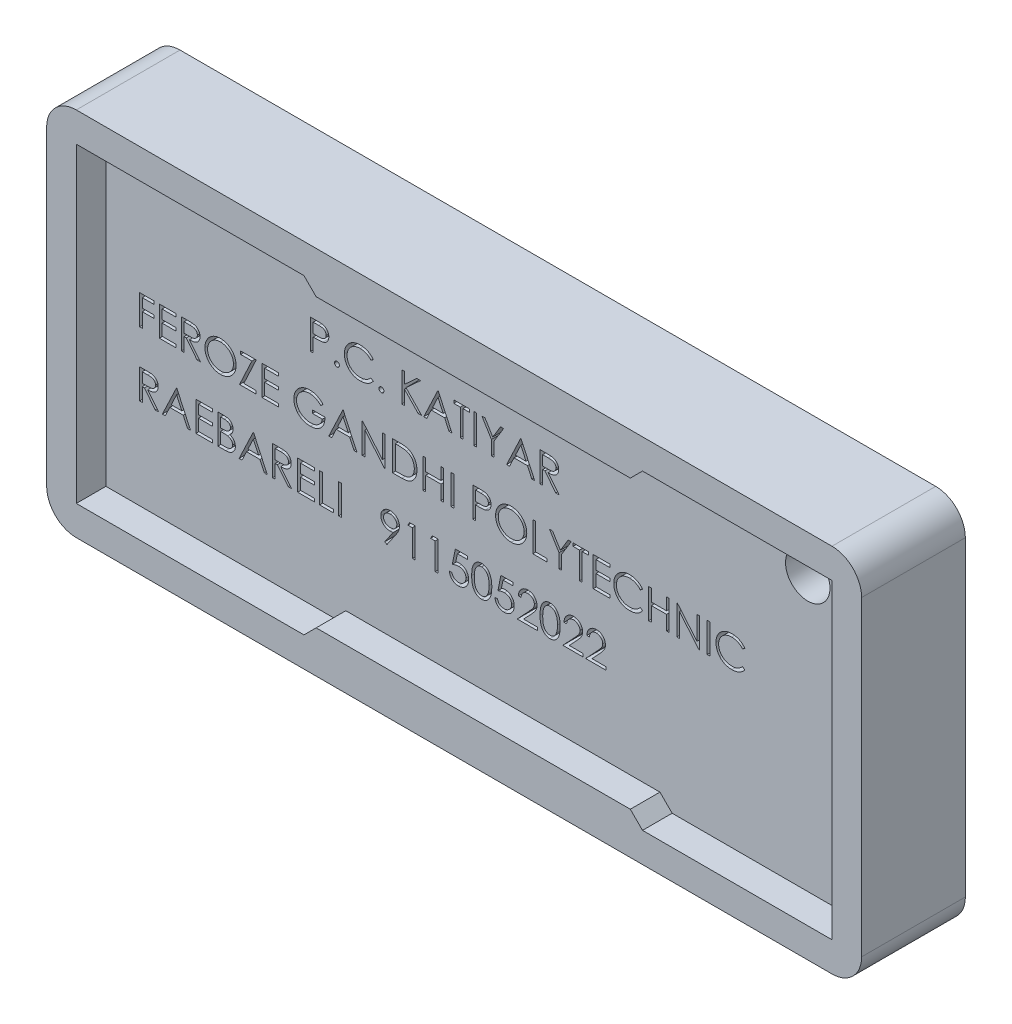
from build123d import *

# Parameters (mm, degrees)
BOSS_EXTRUDE1_DEPTH = 7
CUT_EXTRUDE1_DEPTH  = 2
CUT_EXTRUDE2_DEPTH  = 2
SKETCH4_W           = 0.179487179
SKETCH4_H           = 2
SKETCH4_W_2         = 0.17948718
CUT_EXTRUDE7_DEPTH  = 2
SKETCH5_R           = 1.5
CUT_EXTRUDE8_DEPTH  = 3


with BuildPart() as part:
    # Sketch1 → Boss-Extrude1 (new body)
    with BuildSketch(Plane.XY):
        with BuildLine():
            Line((-25.5, -12.5), (25.5, -12.5))
            ThreePointArc((25.5, -12.5), (26.914213562, -11.914213562), (27.5, -10.5))
            Line((27.5, -10.5), (27.5, 10.5))
            ThreePointArc((27.5, 10.5), (26.914213562, 11.914213562), (25.5, 12.5))
            Line((25.5, 12.5), (-25.5, 12.5))
            ThreePointArc((-25.5, 12.5), (-26.914213562, 11.914213562), (-27.5, 10.5))
            Line((-27.5, 10.5), (-27.5, -10.5))
            ThreePointArc((-27.5, -10.5), (-26.914213562, -11.914213562), (-25.5, -12.5))
        make_face()
    extrude(amount=BOSS_EXTRUDE1_DEPTH)

    # Sketch2 → Cut-Extrude1 (cut)
    with BuildSketch(Plane(origin=(0, 0, 0), x_dir=(-1, 0, 0), z_dir=(0, 0, -1))):
        Polygon((9.271977879, 9.676470588), (10.095507291, 10.5), (25.5, 10.5), (25.5, -10.5), (10.095507291, -10.5), (9.271977879, -9.676470588), (-10.728443028, -9.676470588), (-11.55197244, -10.5), (-25.5, -10.5), (-25.5, 10.5), (-11.55197244, 10.5), (-10.728443028, 9.676470588), align=None)
    extrude(amount=-CUT_EXTRUDE1_DEPTH, mode=Mode.SUBTRACT)

    # Sketch3 → Cut-Extrude2 (cut)
    with BuildSketch(Plane.XY.offset(7)):
        Polygon((11.889346563, -9.676470588), (12.712875975, -10.5), (25.5, -10.5), (25.5, 10.5), (12.712875975, 10.5), (11.889346563, 9.676470588), (-9.312333999, 9.676470588), (-10.13586341, 10.5), (-25.5, 10.5), (-25.5, -10.5), (-10.13586341, -10.5), (-9.312333999, -9.676470588), align=None)
    extrude(amount=-CUT_EXTRUDE2_DEPTH, mode=Mode.SUBTRACT)

    # Sketch4 → Cut-Extrude7 (cut)
    # profile 1 of 53: a face of its own
    with BuildSketch(Plane.XY.offset(5)):
        with BuildLine():
            Line((-11.689072178, 6.293989756), (-11.296844614, 6.293989756))
            add(Edge.make_bspline(
                [(-11.296844614, 6.293989756), (-11.269866953, 6.293960101), (-11.218176557, 6.29390328), (-11.144053668, 6.292180568), (-11.076733821, 6.289879601), (-11.016362175, 6.286689948), (-10.962752976, 6.282920468), (-10.916148805, 6.277633588), (-10.876183344, 6.272113419), (-10.852236802, 6.266501187), (-10.841315768, 6.263941679)],
                knots=[0, 0, 0, 0, 1.415646017, 2.712440637, 3.8905458, 4.950247383, 5.884950622, 6.709939814, 7.411656543, 8, 8, 8, 8], degree=3))
            add(Edge.make_bspline(
                [(-10.841315768, 6.263941679), (-10.827490891, 6.260157707), (-10.800166904, 6.252678929), (-10.760794879, 6.237699659), (-10.723335539, 6.219938421), (-10.687660363, 6.19969617), (-10.654207744, 6.176104419), (-10.622478578, 6.150119495), (-10.592752875, 6.121141455), (-10.565197794, 6.089495318), (-10.539892195, 6.055712341), (-10.518103805, 6.01928821), (-10.499859675, 5.980836037), (-10.484212091, 5.940382567), (-10.472950117, 5.897588097), (-10.464466175, 5.852749975), (-10.459081245, 5.80587301), (-10.458565495, 5.7738388), (-10.458302947, 5.757531422)],
                knots=[0, 0, 0, 0, 0.999701418, 1.975846123, 2.934577507, 3.890451536, 4.834027766, 5.787354733, 6.749476667, 7.726910423, 8.712836071, 9.690891519, 10.682875813, 11.679750201, 12.712814741, 13.765529915, 14.8625177, 16, 16, 16, 16], degree=3))
            add(Edge.make_bspline(
                [(-10.458302947, 5.757531422), (-10.458543761, 5.741086978), (-10.45901493, 5.708912313), (-10.46466995, 5.661842149), (-10.472287203, 5.616860211), (-10.483999804, 5.57406624), (-10.499340189, 5.533714371), (-10.517335648, 5.495187952), (-10.539040522, 5.459142426), (-10.563980425, 5.42544693), (-10.591724193, 5.394069837), (-10.622154443, 5.365238526), (-10.655148325, 5.339121761), (-10.690600981, 5.315660993), (-10.728858037, 5.295400262), (-10.769339268, 5.277253231), (-10.812396534, 5.262012625), (-10.842192257, 5.253995447), (-10.857341409, 5.249919243)],
                knots=[0, 0, 0, 0, 1.121902311, 2.195077645, 3.232258892, 4.234102512, 5.217864754, 6.176164875, 7.132989551, 8.084763148, 9.034132444, 9.988522005, 10.94243251, 11.903244335, 12.886203696, 13.894208494, 14.929344452, 16, 16, 16, 16], degree=3))
            add(Edge.make_bspline(
                [(-10.857341409, 5.249919243), (-10.869871314, 5.247254682), (-10.897331329, 5.241415143), (-10.942555742, 5.234896024), (-10.995210248, 5.229331681), (-11.05522298, 5.225159603), (-11.122540068, 5.221587963), (-11.197197929, 5.218749053), (-11.279343116, 5.217189136), (-11.33664097, 5.217108683), (-11.366556152, 5.217066679)],
                knots=[0, 0, 0, 0, 0.601384939, 1.31797006, 2.144135048, 3.087295005, 4.142315834, 5.309527816, 6.595305764, 8, 8, 8, 8], degree=3))
            Line((-11.366556152, 5.217066679), (-11.509584998, 5.217066679))
            Line((-11.509584998, 5.217066679), (-11.509584998, 4.293989756))
            Line((-11.509584998, 4.293989756), (-11.689072178, 4.293989756))
            Line((-11.689072178, 4.293989756), (-11.689072178, 6.293989756))
        make_face()
        with BuildLine():
            Line((-11.509584998, 6.08886155), (-11.509584998, 5.422194884))
            Line((-11.509584998, 5.422194884), (-11.159424742, 5.417787832))
            add(Edge.make_bspline(
                [(-11.159424742, 5.417787832), (-11.142327641, 5.417778996), (-11.109322041, 5.417761938), (-11.0616442, 5.420039208), (-11.017410321, 5.422668084), (-10.976756278, 5.426517183), (-10.939663744, 5.431957902), (-10.90607087, 5.437450323), (-10.876238137, 5.445396245), (-10.841324308, 5.456095142), (-10.802419538, 5.474342351), (-10.760095224, 5.500828002), (-10.724226318, 5.534588407), (-10.693187291, 5.572547167), (-10.668555361, 5.614775241), (-10.650523365, 5.659957491), (-10.639928418, 5.707630548), (-10.638507736, 5.740252341), (-10.637790126, 5.75673014)],
                knots=[0, 0, 0, 0, 1.160613943, 2.240541288, 3.23993089, 4.169200891, 5.011653406, 5.7853311, 6.478053781, 7.106038997, 8.262395093, 9.384106736, 10.481365981, 11.59014053, 12.70357646, 13.786202915, 14.881775077, 16, 16, 16, 16], degree=3))
            add(Edge.make_bspline(
                [(-10.637790126, 5.75673014), (-10.638511639, 5.772809291), (-10.639945916, 5.804772652), (-10.650606409, 5.851617658), (-10.668520303, 5.896323775), (-10.693352642, 5.938022681), (-10.723490431, 5.975844854), (-10.758518627, 6.008700356), (-10.798354776, 6.035112757), (-10.835410908, 6.052160347), (-10.868325872, 6.062569075), (-10.896915563, 6.069851841), (-10.929195949, 6.075666474), (-10.965177537, 6.080374761), (-11.004581442, 6.08440531), (-11.047746193, 6.087140154), (-11.094508275, 6.088740986), (-11.126971459, 6.088820389), (-11.143799742, 6.08886155)],
                knots=[0, 0, 0, 0, 1.120700087, 2.227813068, 3.331159281, 4.466773991, 5.599788987, 6.693661531, 7.80175334, 8.91857717, 9.525282508, 10.207424825, 10.974604443, 11.810962634, 12.737642355, 13.736264703, 14.826523623, 16, 16, 16, 16], degree=3))
            Line((-11.143799742, 6.08886155), (-11.509584998, 6.08886155))
        make_face(mode=Mode.SUBTRACT)
    # profile 2 of 53: a face of its own
    with BuildSketch(Plane.XY.offset(5)):
        with BuildLine():
            add(Edge.make_bspline(
                [(-9.907020896, 4.601682063), (-9.895883632, 4.601020254), (-9.874050327, 4.599722853), (-9.842485111, 4.590821897), (-9.813916734, 4.575016948), (-9.788469737, 4.553952503), (-9.767494608, 4.528412124), (-9.751126407, 4.500071605), (-9.742302986, 4.468242124), (-9.741015037, 4.446282309), (-9.740354229, 4.435015397)],
                knots=[0, 0, 0, 0, 1.020151414, 1.999887582, 2.974338812, 3.990962822, 5.007586832, 5.987933904, 6.967670073, 8, 8, 8, 8], degree=3))
            add(Edge.make_bspline(
                [(-9.740354229, 4.435015397), (-9.741037429, 4.424019208), (-9.742384691, 4.402334886), (-9.751106181, 4.370745479), (-9.767619353, 4.342387248), (-9.788325063, 4.316500312), (-9.813923025, 4.295391243), (-9.842552651, 4.27972076), (-9.873976227, 4.270182486), (-9.895871269, 4.268967459), (-9.907020896, 4.26834873)],
                knots=[0, 0, 0, 0, 1.009421747, 1.99056486, 2.972319754, 3.999869655, 5.017953583, 5.993804169, 6.978383603, 8, 8, 8, 8], degree=3))
            add(Edge.make_bspline(
                [(-9.907020896, 4.26834873), (-9.918178556, 4.268945071), (-9.939961232, 4.270109285), (-9.971267514, 4.279916603), (-10.000071496, 4.295244295), (-10.025664474, 4.316539672), (-10.046543601, 4.342254039), (-10.062329534, 4.37094078), (-10.071809619, 4.402244459), (-10.073056404, 4.424001397), (-10.073687562, 4.435015397)],
                knots=[0, 0, 0, 0, 1.022052826, 1.995314843, 2.982371812, 4.00089066, 5.028879526, 6.005146991, 6.990147033, 8, 8, 8, 8], degree=3))
            add(Edge.make_bspline(
                [(-10.073687562, 4.435015397), (-10.073080649, 4.446300756), (-10.071895724, 4.468334036), (-10.062309632, 4.499876383), (-10.046666082, 4.528544063), (-10.025520142, 4.553913537), (-10.000077688, 4.575163425), (-9.971336999, 4.590629021), (-9.939885833, 4.599794971), (-9.918165868, 4.601042123), (-9.907020896, 4.601682063)],
                knots=[0, 0, 0, 0, 1.032775665, 2.016367738, 2.991239715, 4.008302682, 5.025365648, 6.011011707, 6.979408107, 8, 8, 8, 8], degree=3))
        make_face()
    # profile 3 of 53: a face of its own
    with BuildSketch(Plane.XY.offset(5)):
        with BuildLine():
            Line((-7.458302947, 5.927002576), (-7.615354229, 5.806810268))
            add(Edge.make_bspline(
                [(-7.615354229, 5.806810268), (-7.626557594, 5.820162251), (-7.648813278, 5.846686203), (-7.684618536, 5.883931657), (-7.721933761, 5.918826092), (-7.760744687, 5.951535738), (-7.801749898, 5.980916747), (-7.843956069, 6.008500234), (-7.888069238, 6.033224656), (-7.949070229, 6.063203505), (-8.028868999, 6.094487022), (-8.129323193, 6.12071744), (-8.234186678, 6.137415255), (-8.305728164, 6.139223735), (-8.34211705, 6.140143602)],
                knots=[0, 0, 0, 0, 0.757959112, 1.505699292, 2.245454638, 2.979532153, 3.711538275, 4.438200793, 5.171680507, 5.909471876, 7.393775596, 8.890124382, 10.418191784, 12, 12, 12, 12], degree=3))
            add(Edge.make_bspline(
                [(-8.34211705, 6.140143602), (-8.362164649, 6.139912766), (-8.402073788, 6.139453237), (-8.461301487, 6.13339088), (-8.51942323, 6.124870188), (-8.576401211, 6.112227146), (-8.632162902, 6.096242793), (-8.687072846, 6.077142556), (-8.740336046, 6.053511219), (-8.792689325, 6.027392213), (-8.842848874, 5.997890816), (-8.890308901, 5.965711758), (-8.934896311, 5.931215132), (-8.976646375, 5.894271642), (-9.015601774, 5.855047665), (-9.051480238, 5.813125184), (-9.084157615, 5.768638228), (-9.114281629, 5.722173423), (-9.141260334, 5.673866114), (-9.163848837, 5.623537502), (-9.183851764, 5.572049443), (-9.199679902, 5.518820208), (-9.212208198, 5.464224342), (-9.220852577, 5.408115321), (-9.226845989, 5.350610361), (-9.227303233, 5.311633611), (-9.227533716, 5.29198655)],
                knots=[0, 0, 0, 0, 1.054917814, 2.100044995, 3.131103042, 4.146048494, 5.169673617, 6.183595914, 7.203665975, 8.234915748, 9.262203917, 10.264457458, 11.251630812, 12.227803204, 13.197192746, 14.159520551, 15.12972552, 16.100847026, 17.073214652, 18.039054194, 19.002613845, 19.979014051, 20.95965708, 21.949030935, 22.966165397, 24, 24, 24, 24], degree=3))
            add(Edge.make_bspline(
                [(-9.227533716, 5.29198655), (-9.226812677, 5.262425796), (-9.225397011, 5.204387176), (-9.212797963, 5.119375399), (-9.193652197, 5.037935014), (-9.164957582, 4.960575104), (-9.129575267, 4.886341756), (-9.084866346, 4.816490983), (-9.033085468, 4.749967232), (-8.973500085, 4.68834269), (-8.908125333, 4.632049133), (-8.837983669, 4.582477372), (-8.763249791, 4.541154582), (-8.684748859, 4.506768327), (-8.601876794, 4.480335911), (-8.514782621, 4.461727841), (-8.423655767, 4.449589452), (-8.361387538, 4.448427344), (-8.329697178, 4.447835909)],
                knots=[0, 0, 0, 0, 1.029171465, 2.020641659, 2.987623507, 3.938342917, 4.889210282, 5.84687017, 6.821220943, 7.821438502, 8.827599549, 9.822697543, 10.807740252, 11.797342354, 12.80366471, 13.83203677, 14.896651826, 16, 16, 16, 16], degree=3))
            add(Edge.make_bspline(
                [(-8.329697178, 4.447835909), (-8.294781355, 4.448800926), (-8.226058665, 4.450700311), (-8.125276935, 4.46679131), (-8.028799355, 4.492881549), (-7.936620734, 4.529394647), (-7.849000936, 4.576860526), (-7.765802845, 4.63440217), (-7.686956233, 4.702566932), (-7.639544072, 4.754614434), (-7.615354229, 4.781169243)],
                knots=[0, 0, 0, 0, 1.028121516, 2.023589091, 2.998037872, 3.967518031, 4.937445131, 5.927275754, 6.942489185, 8, 8, 8, 8], degree=3))
            Line((-7.615354229, 4.781169243), (-7.458302947, 4.662178858))
            add(Edge.make_bspline(
                [(-7.458302947, 4.662178858), (-7.470941867, 4.645871171), (-7.496159167, 4.613333911), (-7.53699232, 4.567464362), (-7.580007918, 4.524319199), (-7.625525467, 4.484246273), (-7.673021348, 4.446443721), (-7.723348383, 4.411985531), (-7.775844973, 4.38039074), (-7.830333247, 4.351461069), (-7.886755311, 4.325794071), (-7.94504356, 4.303820489), (-8.004946746, 4.284891981), (-8.066467608, 4.269319446), (-8.129733755, 4.257164541), (-8.194516883, 4.249039012), (-8.260956811, 4.243472204), (-8.305780481, 4.242964824), (-8.328495255, 4.242707704)],
                knots=[0, 0, 0, 0, 0.986787822, 1.968848986, 2.935600012, 3.899624008, 4.868462664, 5.837806735, 6.815139263, 7.798259679, 8.787526145, 9.778297419, 10.776456485, 11.791383307, 12.812564526, 13.85620153, 14.913611965, 16, 16, 16, 16], degree=3))
            add(Edge.make_bspline(
                [(-8.328495255, 4.242707704), (-8.350005922, 4.242857414), (-8.392540602, 4.243153447), (-8.455339888, 4.247948972), (-8.516476792, 4.254491678), (-8.575776578, 4.264343182), (-8.633562849, 4.275968519), (-8.689311755, 4.291552094), (-8.743571875, 4.309008761), (-8.796125212, 4.329525896), (-8.847016469, 4.352678), (-8.896081505, 4.378844606), (-8.943297752, 4.407805671), (-8.989129421, 4.43892282), (-9.032899468, 4.473195564), (-9.074987197, 4.510147926), (-9.115628612, 4.549655361), (-9.140773004, 4.578143849), (-9.153415126, 4.59246732)],
                knots=[0, 0, 0, 0, 1.114604814, 2.203992996, 3.262667896, 4.300477797, 5.318619304, 6.316056647, 7.298880507, 8.271930387, 9.238335007, 10.195173496, 11.151986948, 12.108099108, 13.064862484, 14.031167946, 15.010108607, 16, 16, 16, 16], degree=3))
            add(Edge.make_bspline(
                [(-9.153415126, 4.59246732), (-9.173664066, 4.617347999), (-9.213917481, 4.666808976), (-9.265417872, 4.746972394), (-9.309502189, 4.830668514), (-9.345145572, 4.918337044), (-9.373009991, 5.009781266), (-9.392313531, 5.105047274), (-9.404857305, 5.204046098), (-9.406291756, 5.271381406), (-9.407020896, 5.305608345)],
                knots=[0, 0, 0, 0, 0.994628077, 1.977248131, 2.950237994, 3.925870899, 4.908910175, 5.911660606, 6.938484602, 8, 8, 8, 8], degree=3))
            add(Edge.make_bspline(
                [(-9.407020896, 5.305608345), (-9.406132214, 5.34158289), (-9.404383787, 5.412360561), (-9.389529047, 5.516231392), (-9.365632592, 5.615746477), (-9.331691513, 5.710720045), (-9.288659884, 5.801651634), (-9.235501818, 5.887846608), (-9.17283488, 5.969856208), (-9.101150556, 6.046436066), (-9.02254065, 6.116458553), (-8.93835847, 6.178062098), (-8.848768786, 6.22932925), (-8.754758585, 6.2721842), (-8.65562391, 6.305123893), (-8.551576271, 6.328182857), (-8.442811177, 6.342535495), (-8.368604076, 6.344349899), (-8.330899101, 6.345271807)],
                knots=[0, 0, 0, 0, 1.032925535, 2.032216505, 3.007276963, 3.968222605, 4.92396291, 5.891752235, 6.871517503, 7.883894988, 8.900124299, 9.891468569, 10.874487609, 11.85992873, 12.854644235, 13.869047385, 14.917252991, 16, 16, 16, 16], degree=3))
            add(Edge.make_bspline(
                [(-8.330899101, 6.345271807), (-8.307919403, 6.344996299), (-8.262433404, 6.34445096), (-8.195146174, 6.339133164), (-8.129636273, 6.330268246), (-8.065858569, 6.318201921), (-8.003502788, 6.303226309), (-7.943045508, 6.283717567), (-7.884131973, 6.261410977), (-7.827133739, 6.235720425), (-7.772324282, 6.206882287), (-7.719720671, 6.175216217), (-7.669740752, 6.140761471), (-7.622032839, 6.103811085), (-7.577395004, 6.063583337), (-7.534559873, 6.021184711), (-7.494982114, 5.975393954), (-7.470551717, 5.943162563), (-7.458302947, 5.927002576)],
                knots=[0, 0, 0, 0, 1.096760587, 2.17092713, 3.219439832, 4.250915756, 5.268269357, 6.278326846, 7.281116186, 8.274029601, 9.260640565, 10.235837813, 11.203064059, 12.156899882, 13.114053108, 14.069676657, 15.032185724, 16, 16, 16, 16], degree=3))
        make_face()
    # profile 4 of 53: a face of its own
    with BuildSketch(Plane.XY.offset(5)):
        with BuildLine():
            add(Edge.make_bspline(
                [(-6.907020896, 4.601682063), (-6.895883632, 4.601020254), (-6.874050327, 4.599722853), (-6.842485111, 4.590821897), (-6.813916734, 4.575016948), (-6.788469737, 4.553952503), (-6.767494608, 4.528412124), (-6.751126407, 4.500071605), (-6.742302986, 4.468242124), (-6.741015037, 4.446282309), (-6.740354229, 4.435015397)],
                knots=[0, 0, 0, 0, 1.020151414, 1.999887582, 2.974338812, 3.990962822, 5.007586832, 5.987933904, 6.967670073, 8, 8, 8, 8], degree=3))
            add(Edge.make_bspline(
                [(-6.740354229, 4.435015397), (-6.741037429, 4.424019208), (-6.742384691, 4.402334886), (-6.751106181, 4.370745479), (-6.767619353, 4.342387248), (-6.788325063, 4.316500312), (-6.813923025, 4.295391243), (-6.842552651, 4.27972076), (-6.873976227, 4.270182486), (-6.895871269, 4.268967459), (-6.907020896, 4.26834873)],
                knots=[0, 0, 0, 0, 1.009421747, 1.99056486, 2.972319754, 3.999869655, 5.017953583, 5.993804169, 6.978383603, 8, 8, 8, 8], degree=3))
            add(Edge.make_bspline(
                [(-6.907020896, 4.26834873), (-6.918178556, 4.268945071), (-6.939961232, 4.270109285), (-6.971267514, 4.279916603), (-7.000071496, 4.295244295), (-7.025664474, 4.316539672), (-7.046543601, 4.342254039), (-7.062329534, 4.37094078), (-7.071809619, 4.402244459), (-7.073056404, 4.424001397), (-7.073687562, 4.435015397)],
                knots=[0, 0, 0, 0, 1.022052826, 1.995314843, 2.982371812, 4.00089066, 5.028879526, 6.005146991, 6.990147033, 8, 8, 8, 8], degree=3))
            add(Edge.make_bspline(
                [(-7.073687562, 4.435015397), (-7.073080649, 4.446300756), (-7.071895724, 4.468334036), (-7.062309632, 4.499876383), (-7.046666082, 4.528544063), (-7.025520142, 4.553913537), (-7.000077688, 4.575163425), (-6.971336999, 4.590629021), (-6.939885833, 4.599794971), (-6.918165868, 4.601042123), (-6.907020896, 4.601682063)],
                knots=[0, 0, 0, 0, 1.032775665, 2.016367738, 2.991239715, 4.008302682, 5.025365648, 6.011011707, 6.979408107, 8, 8, 8, 8], degree=3))
        make_face()
    # profile 5 of 53: a face of its own
    with BuildSketch(Plane.XY.offset(5)):
        Polygon((-5.535226024, 6.293989756), (-5.355738844, 6.293989756), (-5.355738844, 5.532371166), (-4.52200487, 6.293989756), (-4.265995255, 6.293989756), (-5.248767691, 5.396553858), (-4.189072178, 4.293989756), (-4.42825487, 4.293989756), (-5.355738844, 5.259133986), (-5.355738844, 4.293989756), (-5.535226024, 4.293989756), align=None)
    # profile 6 of 53: a face of its own
    with BuildSketch(Plane.XY.offset(5)):
        Polygon((-3.073687562, 6.293989756), (-2.150610639, 4.293989756), (-2.345722819, 4.293989756), (-2.641395896, 4.935015397), (-3.548046537, 4.935015397), (-3.852133075, 4.293989756), (-4.048046537, 4.293989756), (-3.099328588, 6.293989756), align=None)
        Polygon((-3.08851128, 5.904166038), (-3.450690768, 5.140143602), (-2.735947178, 5.140143602), align=None, mode=Mode.SUBTRACT)
    # profile 7 of 53: a face of its own
    with BuildSketch(Plane.XY.offset(5)):
        Polygon((-2.022405511, 6.08886155), (-2.022405511, 6.293989756), (-0.97112346, 6.293989756), (-0.97112346, 6.08886155), (-1.407020896, 6.08886155), (-1.407020896, 4.293989756), (-1.586508075, 4.293989756), (-1.586508075, 6.08886155), align=None)
    # profile 8 of 53: a face of its own
    with BuildSketch(Plane.XY.offset(5)):
        with Locations((-0.573687562, 5.293989756)):
            Rectangle(SKETCH4_W, SKETCH4_H)
    # profile 9 of 53: a face of its own
    with BuildSketch(Plane.XY.offset(5)):
        Polygon((-0.124969614, 6.293989756), (0.080559232, 6.293989756), (0.606200258, 5.434614756), (1.131040002, 6.293989756), (1.336568848, 6.293989756), (0.695543207, 5.244710909), (0.695543207, 4.293989756), (0.516056027, 4.293989756), (0.516056027, 5.244710909), align=None)
    # profile 10 of 53: a face of its own
    with BuildSketch(Plane.XY.offset(5)):
        Polygon((2.516056027, 6.293989756), (3.43913295, 4.293989756), (3.244020771, 4.293989756), (2.948347694, 4.935015397), (2.041697053, 4.935015397), (1.737610515, 4.293989756), (1.541697053, 4.293989756), (2.490415002, 6.293989756), align=None)
        Polygon((2.501232309, 5.904166038), (2.139052822, 5.140143602), (2.853796412, 5.140143602), align=None, mode=Mode.SUBTRACT)
    # profile 11 of 53: a face of its own
    with BuildSketch(Plane.XY.offset(5)):
        with BuildLine():
            Line((3.798107309, 6.293989756), (4.198347694, 6.293989756))
            add(Edge.make_bspline(
                [(4.198347694, 6.293989756), (4.22505691, 6.293900849), (4.276341564, 6.293730139), (4.349812004, 6.292778275), (4.416570346, 6.290050072), (4.476581682, 6.28770231), (4.529844914, 6.2834212), (4.576523366, 6.279329402), (4.61640205, 6.273973024), (4.640542536, 6.268998497), (4.651472694, 6.266746166)],
                knots=[0, 0, 0, 0, 1.410062039, 2.707475311, 3.878576406, 4.937260626, 5.877586885, 6.699081471, 7.410979367, 8, 8, 8, 8], degree=3))
            add(Edge.make_bspline(
                [(4.651472694, 6.266746166), (4.666105051, 6.263130871), (4.695057616, 6.255977406), (4.736743368, 6.240857634), (4.776465839, 6.223360706), (4.814060024, 6.202810009), (4.849337619, 6.179052992), (4.882662368, 6.152499779), (4.91418549, 6.123295661), (4.942632136, 6.090704323), (4.969454451, 6.056512032), (4.992076524, 6.019538457), (5.011577369, 5.980874727), (5.027103379, 5.940127631), (5.039605078, 5.897692333), (5.048420072, 5.853184449), (5.053706465, 5.806806749), (5.054244668, 5.775173658), (5.054517566, 5.759133986)],
                knots=[0, 0, 0, 0, 1.027469482, 2.033020251, 3.019912614, 3.986113645, 4.951240523, 5.91722682, 6.890402269, 7.87763091, 8.8651537, 9.85103654, 10.82876324, 11.815024772, 12.821070561, 13.842952187, 14.906261191, 16, 16, 16, 16], degree=3))
            add(Edge.make_bspline(
                [(5.054517566, 5.759133986), (5.053678138, 5.732485355), (5.052040198, 5.680486973), (5.03676871, 5.605023613), (5.011753556, 5.534629719), (4.977283105, 5.469393925), (4.933386262, 5.410587842), (4.880629238, 5.358936154), (4.818982603, 5.315713346), (4.761594423, 5.285740315), (4.710900594, 5.266544367), (4.669167273, 5.253037877), (4.623643286, 5.242602468), (4.574764809, 5.233253821), (4.522328434, 5.22619571), (4.46645984, 5.221026228), (4.407119182, 5.217795343), (4.366354, 5.217314197), (4.34538295, 5.217066679)],
                knots=[0, 0, 0, 0, 1.260483769, 2.459530307, 3.627416485, 4.787058657, 5.939039949, 7.08810263, 8.267026773, 9.491475466, 10.141966685, 10.831826277, 11.566392101, 12.351337768, 13.187381173, 14.07005841, 15.007169909, 16, 16, 16, 16], degree=3))
            Line((4.34538295, 5.217066679), (5.080158591, 4.293989756))
            Line((5.080158591, 4.293989756), (4.858203463, 4.293989756))
            Line((4.858203463, 4.293989756), (4.123427822, 5.217066679))
            Line((4.123427822, 5.217066679), (3.977594489, 5.217066679))
            Line((3.977594489, 5.217066679), (3.977594489, 4.293989756))
            Line((3.977594489, 4.293989756), (3.798107309, 4.293989756))
            Line((3.798107309, 4.293989756), (3.798107309, 6.293989756))
        make_face()
        with BuildLine():
            Line((3.977594489, 6.08886155), (3.977594489, 5.422194884))
            Line((3.977594489, 5.422194884), (4.343780386, 5.419390397))
            add(Edge.make_bspline(
                [(4.343780386, 5.419390397), (4.360877551, 5.419382833), (4.394016727, 5.419368172), (4.441959964, 5.42165033), (4.486600028, 5.424246512), (4.527766172, 5.428217566), (4.565476786, 5.433335322), (4.599713022, 5.439737027), (4.630530766, 5.447195348), (4.666472788, 5.458739134), (4.706607949, 5.477028288), (4.750225926, 5.503637144), (4.787370119, 5.537105212), (4.818751755, 5.575375759), (4.843968573, 5.617453615), (4.86174689, 5.662834397), (4.873028285, 5.710372453), (4.874358883, 5.743045658), (4.875030386, 5.759534627)],
                knots=[0, 0, 0, 0, 1.146690395, 2.22261258, 3.21895312, 4.145990853, 4.996080663, 5.770904154, 6.481378293, 7.121626537, 8.300444488, 9.431385265, 10.535395872, 11.636531494, 12.74115979, 13.810798291, 14.895190096, 16, 16, 16, 16], degree=3))
            add(Edge.make_bspline(
                [(4.875030386, 5.759534627), (4.87434346, 5.775618384), (4.872982223, 5.80749052), (4.861868641, 5.85415104), (4.843074708, 5.898189297), (4.817747715, 5.939426146), (4.786891055, 5.976857995), (4.750709448, 6.00888494), (4.710192194, 6.035313205), (4.672322938, 6.052201423), (4.638474816, 6.062555625), (4.609086439, 6.069842004), (4.57587988, 6.075695986), (4.538693904, 6.080386307), (4.497687258, 6.084417703), (4.4526526, 6.087133005), (4.403888726, 6.088740928), (4.370090479, 6.088820407), (4.352594489, 6.08886155)],
                knots=[0, 0, 0, 0, 1.101028733, 2.181837193, 3.264309656, 4.369019818, 5.486613113, 6.575447106, 7.666700264, 8.788928104, 9.402425223, 10.0903467, 10.862060571, 11.710948788, 12.657782767, 13.684531032, 14.801375019, 16, 16, 16, 16], degree=3))
            Line((4.352594489, 6.08886155), (3.977594489, 6.08886155))
        make_face(mode=Mode.SUBTRACT)
    # profile 12 of 53: a face of its own
    with BuildSketch(Plane.XY.offset(5)):
        Polygon((-23.227533716, 1.960656422), (-22.253174742, 1.960656422), (-22.253174742, 1.755528217), (-23.048046537, 1.755528217), (-23.048046537, 1.140143602), (-22.253174742, 1.140143602), (-22.253174742, 0.935015397), (-23.048046537, 0.935015397), (-23.048046537, -0.039343578), (-23.227533716, -0.039343578), align=None)
    # profile 13 of 53: a face of its own
    with BuildSketch(Plane.XY.offset(5)):
        Polygon((-21.894200383, 1.960656422), (-20.765995255, 1.960656422), (-20.765995255, 1.755528217), (-21.714713203, 1.755528217), (-21.714713203, 1.140143602), (-20.765995255, 1.140143602), (-20.765995255, 0.935015397), (-21.714713203, 0.935015397), (-21.714713203, 0.165784627), (-20.765995255, 0.165784627), (-20.765995255, -0.039343578), (-21.894200383, -0.039343578), align=None)
    # profile 14 of 53: a face of its own
    with BuildSketch(Plane.XY.offset(5)):
        with BuildLine():
            Line((-20.407020896, 1.960656422), (-20.006780511, 1.960656422))
            add(Edge.make_bspline(
                [(-20.006780511, 1.960656422), (-19.980071295, 1.960567516), (-19.928786641, 1.960396806), (-19.855316201, 1.959444941), (-19.78855786, 1.956716738), (-19.728546523, 1.954368976), (-19.675283291, 1.950087867), (-19.628604839, 1.945996069), (-19.588726155, 1.940639691), (-19.564585669, 1.935665164), (-19.553655511, 1.933412832)],
                knots=[0, 0, 0, 0, 1.410062039, 2.707475311, 3.878576406, 4.937260626, 5.877586885, 6.699081471, 7.410979367, 8, 8, 8, 8], degree=3))
            add(Edge.make_bspline(
                [(-19.553655511, 1.933412832), (-19.539023154, 1.929797538), (-19.510070589, 1.922644073), (-19.468384837, 1.907524301), (-19.428662366, 1.890027373), (-19.391068181, 1.869476675), (-19.355790586, 1.845719658), (-19.322465837, 1.819166446), (-19.290942715, 1.789962328), (-19.262496069, 1.75737099), (-19.235673754, 1.723178699), (-19.213051682, 1.686205123), (-19.193550836, 1.647541393), (-19.178024826, 1.606794298), (-19.165523127, 1.564358999), (-19.156708133, 1.519851116), (-19.15142174, 1.473473416), (-19.150883537, 1.441840325), (-19.150610639, 1.425800653)],
                knots=[0, 0, 0, 0, 1.027469482, 2.033020251, 3.019912614, 3.986113645, 4.951240523, 5.91722682, 6.890402269, 7.87763091, 8.8651537, 9.85103654, 10.82876324, 11.815024772, 12.821070561, 13.842952187, 14.906261191, 16, 16, 16, 16], degree=3))
            add(Edge.make_bspline(
                [(-19.150610639, 1.425800653), (-19.151450067, 1.399152022), (-19.153088007, 1.34715364), (-19.168359495, 1.271690279), (-19.193374649, 1.201296385), (-19.2278451, 1.136060592), (-19.271741943, 1.077254509), (-19.324498967, 1.02560282), (-19.386145602, 0.982380013), (-19.443533782, 0.952406982), (-19.494227611, 0.933211034), (-19.535960932, 0.919704543), (-19.58148492, 0.909269135), (-19.630363397, 0.899920488), (-19.682799771, 0.892862377), (-19.738668365, 0.887692894), (-19.798009023, 0.884462009), (-19.838774206, 0.883980864), (-19.859745255, 0.883733345)],
                knots=[0, 0, 0, 0, 1.260483769, 2.459530307, 3.627416485, 4.787058657, 5.939039949, 7.08810263, 8.267026773, 9.491475466, 10.141966685, 10.831826277, 11.566392101, 12.351337768, 13.187381173, 14.07005841, 15.007169909, 16, 16, 16, 16], degree=3))
            Line((-19.859745255, 0.883733345), (-19.124969614, -0.039343578))
            Line((-19.124969614, -0.039343578), (-19.346924742, -0.039343578))
            Line((-19.346924742, -0.039343578), (-20.081700383, 0.883733345))
            Line((-20.081700383, 0.883733345), (-20.227533716, 0.883733345))
            Line((-20.227533716, 0.883733345), (-20.227533716, -0.039343578))
            Line((-20.227533716, -0.039343578), (-20.407020896, -0.039343578))
            Line((-20.407020896, -0.039343578), (-20.407020896, 1.960656422))
        make_face()
        with BuildLine():
            Line((-20.227533716, 1.755528217), (-20.227533716, 1.08886155))
            Line((-20.227533716, 1.08886155), (-19.861347819, 1.086057063))
            add(Edge.make_bspline(
                [(-19.861347819, 1.086057063), (-19.844250654, 1.086049499), (-19.811111478, 1.086034839), (-19.763168241, 1.088316996), (-19.718528177, 1.090913178), (-19.677362033, 1.094884233), (-19.639651419, 1.100001988), (-19.605415183, 1.106403693), (-19.574597439, 1.113862015), (-19.538655417, 1.125405801), (-19.498520256, 1.143694954), (-19.454902279, 1.170303811), (-19.417758086, 1.203771879), (-19.38637645, 1.242042425), (-19.361159632, 1.284120282), (-19.343381316, 1.329501064), (-19.33209992, 1.37703912), (-19.330769323, 1.409712325), (-19.330097819, 1.426201294)],
                knots=[0, 0, 0, 0, 1.146690395, 2.22261258, 3.21895312, 4.145990853, 4.996080663, 5.770904154, 6.481378293, 7.121626537, 8.300444488, 9.431385265, 10.535395872, 11.636531494, 12.74115979, 13.810798291, 14.895190096, 16, 16, 16, 16], degree=3))
            add(Edge.make_bspline(
                [(-19.330097819, 1.426201294), (-19.330784745, 1.44228505), (-19.332145982, 1.474157187), (-19.343259564, 1.520817707), (-19.362053497, 1.564855964), (-19.38738049, 1.606092813), (-19.41823715, 1.643524662), (-19.454418757, 1.675551606), (-19.494936011, 1.701979872), (-19.532805268, 1.718868089), (-19.566653389, 1.729222291), (-19.596041766, 1.736508671), (-19.629248325, 1.742362653), (-19.666434301, 1.747052973), (-19.707440947, 1.75108437), (-19.752475605, 1.753799672), (-19.80123948, 1.755407594), (-19.835037726, 1.755487074), (-19.852533716, 1.755528217)],
                knots=[0, 0, 0, 0, 1.101028733, 2.181837193, 3.264309656, 4.369019818, 5.486613113, 6.575447106, 7.666700264, 8.788928104, 9.402425223, 10.0903467, 10.862060571, 11.710948788, 12.657782767, 13.684531032, 14.801375019, 16, 16, 16, 16], degree=3))
            Line((-19.852533716, 1.755528217), (-20.227533716, 1.755528217))
        make_face(mode=Mode.SUBTRACT)
    # profile 15 of 53: a face of its own
    with BuildSketch(Plane.XY.offset(5)):
        with BuildLine():
            add(Edge.make_bspline(
                [(-17.778815768, 2.011938473), (-17.741782564, 2.011000485), (-17.669046297, 2.009158199), (-17.562146356, 1.995055854), (-17.460092016, 1.970658488), (-17.362051936, 1.938165356), (-17.269198807, 1.894819993), (-17.180833725, 1.842428479), (-17.09716694, 1.780441931), (-17.019326151, 1.709339516), (-16.948093608, 1.631977542), (-16.885335959, 1.549418737), (-16.832740362, 1.462162278), (-16.789548484, 1.370470375), (-16.755663564, 1.274550393), (-16.732281253, 1.173890963), (-16.717345167, 1.069144283), (-16.715599009, 0.99770036), (-16.714713203, 0.961457704)],
                knots=[0, 0, 0, 0, 1.065120563, 2.091984664, 3.0946048, 4.079830382, 5.057816894, 6.036188127, 7.030412546, 8.04752943, 9.064399622, 10.05169764, 11.02544977, 11.989514704, 12.962713494, 13.945757189, 14.957906945, 16, 16, 16, 16], degree=3))
            add(Edge.make_bspline(
                [(-16.714713203, 0.961457704), (-16.715598879, 0.925482021), (-16.717344649, 0.85456978), (-16.732298236, 0.750487812), (-16.755750236, 0.650435986), (-16.789233816, 0.554581327), (-16.832219804, 0.462822719), (-16.885165616, 0.375401603), (-16.947532022, 0.292289318), (-17.018507366, 0.214396366), (-17.09587939, 0.14296924), (-17.178868114, 0.080729883), (-17.265607154, 0.02717324), (-17.357212701, -0.015560288), (-17.452469865, -0.049715671), (-17.552231193, -0.073002888), (-17.656029223, -0.088024056), (-17.726812654, -0.089748922), (-17.762790126, -0.090625629)],
                knots=[0, 0, 0, 0, 1.043624062, 2.057103931, 3.04512605, 4.022047818, 4.998200453, 5.980619268, 6.982898556, 8.009068085, 9.034988726, 10.034168286, 11.015286542, 11.987931943, 12.962482838, 13.94673481, 14.956375938, 16, 16, 16, 16], degree=3))
            add(Edge.make_bspline(
                [(-17.762790126, -0.090625629), (-17.799032594, -0.089740265), (-17.870476146, -0.087994977), (-17.975354452, -0.073034174), (-18.076084592, -0.049639144), (-18.172378507, -0.01620518), (-18.264289895, 0.027004666), (-18.351998514, 0.079692883), (-18.435152312, 0.142211249), (-18.513061882, 0.213163577), (-18.584347138, 0.290404464), (-18.646495352, 0.373166896), (-18.699195417, 0.459827157), (-18.742260179, 0.550625742), (-18.776354155, 0.645123709), (-18.799614051, 0.74395141), (-18.814663167, 0.846545414), (-18.816397365, 0.916398499), (-18.817277306, 0.95184232)],
                knots=[0, 0, 0, 0, 1.053102029, 2.075944431, 3.073151272, 4.055350789, 5.033113405, 6.020478099, 7.024410459, 8.052272461, 9.079885166, 10.07527673, 11.055994387, 12.023226415, 12.992069828, 13.970394897, 14.97016774, 16, 16, 16, 16], degree=3))
            add(Edge.make_bspline(
                [(-18.817277306, 0.95184232), (-18.8169718, 0.975632416), (-18.816364642, 1.022912487), (-18.809055104, 1.093121973), (-18.798448417, 1.162202349), (-18.783247324, 1.229957176), (-18.763366372, 1.296220596), (-18.73990807, 1.361449603), (-18.71125673, 1.42498316), (-18.678867788, 1.48712224), (-18.642718184, 1.546898187), (-18.602789184, 1.603400806), (-18.560483259, 1.657104232), (-18.514104177, 1.706616806), (-18.465180494, 1.753378895), (-18.412918564, 1.796671876), (-18.357637281, 1.836886134), (-18.299098779, 1.873126329), (-18.238745479, 1.905902977), (-18.176530177, 1.934029749), (-18.113297851, 1.958170356), (-18.048752337, 1.977736542), (-17.983065039, 1.99318342), (-17.916092591, 2.003701907), (-17.847888347, 2.011030089), (-17.801939022, 2.011634376), (-17.778815768, 2.011938473)],
                knots=[0, 0, 0, 0, 1.037015668, 2.060948919, 3.074880161, 4.083647147, 5.086022904, 6.090072063, 7.104153813, 8.122640571, 9.144368836, 10.147691507, 11.138137339, 12.123020368, 13.103399296, 14.087645067, 15.080126199, 16.082011238, 17.087798457, 18.072939717, 19.057185487, 20.037253025, 21.01195951, 21.997135196, 22.992090687, 24, 24, 24, 24], degree=3))
        make_face()
        with BuildLine():
            add(Edge.make_bspline(
                [(-17.770001665, 1.806810268), (-17.788981456, 1.806578902), (-17.826759589, 1.806118383), (-17.882922181, 1.800052259), (-17.938346143, 1.791406609), (-17.993042921, 1.779074311), (-18.046783658, 1.762271995), (-18.100069282, 1.742934333), (-18.152413884, 1.719379424), (-18.20364466, 1.69276645), (-18.253310417, 1.663309924), (-18.300174818, 1.630754629), (-18.344359186, 1.595864026), (-18.385755338, 1.558556691), (-18.424241722, 1.518642633), (-18.460575837, 1.476726955), (-18.493301313, 1.431611589), (-18.523293071, 1.384519927), (-18.550131837, 1.33551331), (-18.573997754, 1.285107674), (-18.593520044, 1.232891853), (-18.609441402, 1.179432334), (-18.622641294, 1.124813786), (-18.631003537, 1.068621872), (-18.637136313, 1.011138951), (-18.637570511, 0.972292178), (-18.637790126, 0.952643602)],
                knots=[0, 0, 0, 0, 1.008559885, 2.007477868, 2.99961109, 3.989939068, 4.984837346, 5.991145699, 7.001802488, 8.033829008, 9.059044045, 10.069351652, 11.065060232, 12.050310815, 13.029377138, 14.011219647, 14.996725999, 15.989392538, 16.977580475, 17.965360261, 18.951710183, 19.937753436, 20.929683414, 21.935841486, 22.955955122, 24, 24, 24, 24], degree=3))
            add(Edge.make_bspline(
                [(-18.637790126, 0.952643602), (-18.637061634, 0.923750904), (-18.635628464, 0.86691003), (-18.623081281, 0.783613947), (-18.603754438, 0.703563498), (-18.575264515, 0.627196693), (-18.539635592, 0.553857103), (-18.495620226, 0.484195328), (-18.443472177, 0.418192543), (-18.384235876, 0.356309532), (-18.319480044, 0.299826216), (-18.250718484, 0.250247125), (-18.178687851, 0.208298411), (-18.103200307, 0.174124084), (-18.024658856, 0.147044233), (-17.942557398, 0.128485016), (-17.85744285, 0.11627047), (-17.799425333, 0.115097466), (-17.770001665, 0.114502576)],
                knots=[0, 0, 0, 0, 1.032063989, 2.030389145, 3.003944642, 3.970395727, 4.937377036, 5.913328081, 6.909231446, 7.93887556, 8.970685674, 9.976071282, 10.964166581, 11.944589148, 12.933237628, 13.927779006, 14.949070134, 16, 16, 16, 16], degree=3))
            add(Edge.make_bspline(
                [(-17.770001665, 0.114502576), (-17.750224807, 0.114774293), (-17.711001358, 0.115313189), (-17.652661059, 0.120741004), (-17.595371795, 0.12944493), (-17.539213921, 0.141976733), (-17.484251172, 0.157660851), (-17.430254141, 0.176293838), (-17.377797975, 0.19954024), (-17.326220925, 0.225224784), (-17.276851644, 0.254504874), (-17.229722769, 0.285955245), (-17.186022209, 0.320794457), (-17.144657025, 0.357547493), (-17.106012631, 0.396955406), (-17.070350355, 0.438966961), (-17.037790279, 0.483847337), (-17.00780991, 0.530867569), (-16.981065188, 0.580008284), (-16.957762846, 0.630596672), (-16.937993637, 0.682508163), (-16.922034491, 0.735817632), (-16.909528513, 0.790423832), (-16.900911416, 0.846399876), (-16.894883737, 0.903633786), (-16.894429407, 0.942344561), (-16.894200383, 0.961858345)],
                knots=[0, 0, 0, 0, 1.047197238, 2.076906641, 3.100256066, 4.114471768, 5.12198147, 6.126382909, 7.136867548, 8.15857795, 9.17633901, 10.174870724, 11.156907918, 12.133735059, 13.104061851, 14.077631395, 15.04955518, 16.038496417, 17.029181396, 18.010275684, 18.986308667, 19.968651475, 20.955262928, 21.950658345, 22.966943676, 24, 24, 24, 24], degree=3))
            add(Edge.make_bspline(
                [(-16.894200383, 0.961858345), (-16.89442959, 0.981238633), (-16.894884265, 1.019683005), (-16.900908537, 1.076517758), (-16.909537617, 1.132091022), (-16.92197345, 1.186184624), (-16.938002109, 1.238812352), (-16.957766298, 1.28992478), (-16.981072184, 1.33971232), (-17.00781974, 1.388051918), (-17.037885925, 1.434437482), (-17.070739778, 1.478781718), (-17.106948549, 1.520251856), (-17.145477706, 1.559871681), (-17.18728964, 1.59679619), (-17.232194951, 1.63103763), (-17.279648481, 1.663422358), (-17.329892616, 1.692636965), (-17.381746304, 1.719616526), (-17.43495428, 1.742731385), (-17.488913765, 1.762372596), (-17.543487544, 1.779125148), (-17.59913496, 1.791358308), (-17.655480005, 1.800060051), (-17.712444724, 1.806116271), (-17.750755135, 1.806578202), (-17.770001665, 1.806810268)],
                knots=[0, 0, 0, 0, 1.02996197, 2.043119294, 3.035359645, 4.018872909, 4.991431989, 5.957985074, 6.929999688, 7.912076566, 8.892894881, 9.867085534, 10.843653904, 11.817741046, 12.803660682, 13.806313499, 14.818574707, 15.856120519, 16.894564902, 17.924820532, 18.937903209, 19.946497019, 20.957711757, 21.963978472, 22.977135795, 24, 24, 24, 24], degree=3))
        make_face(mode=Mode.SUBTRACT)
    # profile 16 of 53: a face of its own
    with BuildSketch(Plane.XY.offset(5)):
        Polygon((-16.407020896, 1.755528217), (-16.407020896, 1.960656422), (-15.355738844, 1.960656422), (-16.194681152, 0.165784627), (-15.38137987, 0.165784627), (-15.38137987, -0.039343578), (-16.483943973, -0.039343578), (-15.645001665, 1.755528217), align=None)
    # profile 17 of 53: a face of its own
    with BuildSketch(Plane.XY.offset(5)):
        Polygon((-14.97112346, 1.960656422), (-13.842918332, 1.960656422), (-13.842918332, 1.755528217), (-14.79163628, 1.755528217), (-14.79163628, 1.140143602), (-13.842918332, 1.140143602), (-13.842918332, 0.935015397), (-14.79163628, 0.935015397), (-14.79163628, 0.165784627), (-13.842918332, 0.165784627), (-13.842918332, -0.039343578), (-14.97112346, -0.039343578), align=None)
    # profile 18 of 53: a face of its own
    with BuildSketch(Plane.XY.offset(5)):
        with BuildLine():
            Line((-10.842918332, 1.619310268), (-10.996764485, 1.473476935))
            add(Edge.make_bspline(
                [(-10.996764485, 1.473476935), (-11.02460385, 1.499666), (-11.079618734, 1.551419636), (-11.169310301, 1.618568776), (-11.26288952, 1.676092261), (-11.35986809, 1.722895825), (-11.457844407, 1.76024026), (-11.555517993, 1.786827768), (-11.651886965, 1.803783504), (-11.715982519, 1.805811144), (-11.747565768, 1.806810268)],
                knots=[0, 0, 0, 0, 1.08915593, 2.152340314, 3.188132944, 4.216796309, 5.218260357, 6.173443236, 7.099959455, 8, 8, 8, 8], degree=3))
            add(Edge.make_bspline(
                [(-11.747565768, 1.806810268), (-11.766945596, 1.806573922), (-11.805654991, 1.806101843), (-11.863153244, 1.800076577), (-11.920048466, 1.79141094), (-11.976233251, 1.778872724), (-12.031816843, 1.762981833), (-12.086605925, 1.743104426), (-12.140702699, 1.71993), (-12.193597602, 1.693151444), (-12.24487789, 1.663734389), (-12.293310367, 1.631135223), (-12.339203738, 1.596398771), (-12.38169541, 1.558655355), (-12.421029802, 1.51824686), (-12.458143158, 1.475924971), (-12.491730184, 1.430533417), (-12.522067992, 1.382907345), (-12.549131774, 1.333883237), (-12.573022434, 1.283932957), (-12.593077912, 1.233222183), (-12.608946173, 1.181687282), (-12.622037975, 1.129726945), (-12.631248036, 1.07698139), (-12.636440449, 1.023394142), (-12.637338609, 0.987509994), (-12.637790126, 0.969470525)],
                knots=[0, 0, 0, 0, 1.02818874, 2.053710826, 3.065248034, 4.081641283, 5.106893873, 6.131558223, 7.173050175, 8.228653731, 9.27666206, 10.308777013, 11.325269123, 12.329503258, 13.32196095, 14.316845687, 15.314881793, 16.315733098, 17.311955233, 18.285320748, 19.252783886, 20.203351036, 21.145449891, 22.095197417, 23.042428769, 24, 24, 24, 24], degree=3))
            add(Edge.make_bspline(
                [(-12.637790126, 0.969470525), (-12.637358287, 0.951030058), (-12.636495789, 0.914199479), (-12.630975606, 0.859231437), (-12.620730897, 0.805079779), (-12.607035064, 0.75156656), (-12.589903169, 0.698600132), (-12.56854736, 0.646410127), (-12.543252731, 0.594998475), (-12.513974701, 0.544828408), (-12.481868299, 0.495958109), (-12.445900824, 0.449924096), (-12.407694777, 0.406113366), (-12.365858262, 0.365498644), (-12.32173281, 0.326993561), (-12.274000081, 0.291658977), (-12.223598675, 0.258814278), (-12.170451696, 0.228873409), (-12.115135821, 0.202125675), (-12.058417676, 0.178340591), (-12.000116067, 0.158752399), (-11.940537387, 0.142787768), (-11.879752661, 0.129701884), (-11.817453345, 0.121283323), (-11.754097511, 0.115174277), (-11.711389722, 0.114727608), (-11.68987346, 0.114502576)],
                knots=[0, 0, 0, 0, 0.93586088, 1.869166235, 2.799637598, 3.729985548, 4.670839027, 5.622275134, 6.589130586, 7.576015415, 8.568469353, 9.55398029, 10.53834874, 11.515998671, 12.510579167, 13.508179873, 14.527009472, 15.561807829, 16.601455013, 17.643573243, 18.680854198, 19.719860599, 20.772568776, 21.833555941, 22.908541556, 24, 24, 24, 24], degree=3))
            add(Edge.make_bspline(
                [(-11.68987346, 0.114502576), (-11.663942976, 0.11504462), (-11.613024257, 0.11610901), (-11.538174861, 0.12439489), (-11.466287392, 0.137335915), (-11.397563848, 0.156287856), (-11.331924407, 0.180461384), (-11.269128441, 0.209601605), (-11.20967035, 0.24482621), (-11.153371394, 0.284582706), (-11.101510145, 0.328876896), (-11.05473636, 0.376673727), (-11.01379608, 0.427741194), (-10.978079109, 0.481778517), (-10.948531307, 0.539232977), (-10.924278281, 0.599823013), (-10.905687829, 0.663575877), (-10.898056414, 0.707628238), (-10.894200383, 0.729887191)],
                knots=[0, 0, 0, 0, 1.13008108, 2.219097802, 3.278683437, 4.311054135, 5.322181354, 6.324827112, 7.324222904, 8.330512327, 9.32562643, 10.293043162, 11.24128371, 12.174520618, 13.111833804, 14.052305215, 15.015860969, 16, 16, 16, 16], degree=3))
            Line((-10.894200383, 0.729887191), (-11.56086705, 0.729887191))
            Line((-11.56086705, 0.729887191), (-11.56086705, 0.935015397))
            Line((-11.56086705, 0.935015397), (-10.714713203, 0.935015397))
            add(Edge.make_bspline(
                [(-10.714713203, 0.935015397), (-10.715687974, 0.896782546), (-10.717595776, 0.82195395), (-10.730978013, 0.712828081), (-10.752587449, 0.609758542), (-10.782107627, 0.512636787), (-10.820322073, 0.421600448), (-10.866820661, 0.336557096), (-10.922347587, 0.258056136), (-10.984924982, 0.185456705), (-11.05515353, 0.120697155), (-11.131135598, 0.063779477), (-11.212996723, 0.015835125), (-11.30065947, -0.023170968), (-11.393836861, -0.053613251), (-11.492744506, -0.075197009), (-11.597248278, -0.088128416), (-11.668869236, -0.089780633), (-11.70549846, -0.090625629)],
                knots=[0, 0, 0, 0, 1.140356446, 2.231883559, 3.274166699, 4.278491846, 5.25512956, 6.21435461, 7.1637429, 8.11826594, 9.068280886, 10.0076534, 10.945064095, 11.891975133, 12.864533718, 13.863980011, 14.907571808, 16, 16, 16, 16], degree=3))
            add(Edge.make_bspline(
                [(-11.70549846, -0.090625629), (-11.72807568, -0.090300417), (-11.772605235, -0.089658994), (-11.838371479, -0.08510051), (-11.902324405, -0.078083037), (-11.964454696, -0.067485824), (-12.024990892, -0.054506022), (-12.083630655, -0.037885039), (-12.140597364, -0.018645783), (-12.19597907, 0.003237459), (-12.249273097, 0.028592692), (-12.300716821, 0.056769629), (-12.350594607, 0.087622978), (-12.398566702, 0.121686318), (-12.444883057, 0.158704867), (-12.489245024, 0.19875282), (-12.531900955, 0.241707746), (-12.55862122, 0.272210037), (-12.572084998, 0.287579499)],
                knots=[0, 0, 0, 0, 1.107784379, 2.184907829, 3.233506516, 4.263428166, 5.276301166, 6.270063455, 7.25232949, 8.225834625, 9.190232166, 10.146266622, 11.1027726, 12.066435141, 13.031522626, 14.010570082, 14.99756817, 16, 16, 16, 16], degree=3))
            add(Edge.make_bspline(
                [(-12.572084998, 0.287579499), (-12.591619817, 0.311962729), (-12.630365195, 0.360324453), (-12.680238428, 0.437810136), (-12.722753515, 0.51803977), (-12.757249413, 0.601236701), (-12.784185463, 0.687323108), (-12.803503321, 0.776188989), (-12.814821772, 0.867948778), (-12.816452365, 0.930043215), (-12.817277306, 0.961457704)],
                knots=[0, 0, 0, 0, 1.023165419, 2.029347347, 3.013907458, 3.994755782, 4.975994455, 5.96558838, 6.970761222, 8, 8, 8, 8], degree=3))
            add(Edge.make_bspline(
                [(-12.817277306, 0.961457704), (-12.81697317, 0.984981277), (-12.816368763, 1.031729453), (-12.809039897, 1.101133629), (-12.798524801, 1.169305453), (-12.783069341, 1.236189199), (-12.763585761, 1.301829537), (-12.739269483, 1.366256945), (-12.710958114, 1.429509443), (-12.678052116, 1.491151654), (-12.641432425, 1.550365604), (-12.601689442, 1.60691292), (-12.558258814, 1.659763814), (-12.511849785, 1.709587613), (-12.461908648, 1.755758383), (-12.408903263, 1.798703589), (-12.352792781, 1.838480838), (-12.293400679, 1.874463601), (-12.23161343, 1.90678567), (-12.167579144, 1.935122362), (-12.101317366, 1.958541399), (-12.033324522, 1.978412131), (-11.96308595, 1.993106497), (-11.891111357, 2.003762923), (-11.817025579, 2.011054694), (-11.766947848, 2.011641126), (-11.741556152, 2.011938473)],
                knots=[0, 0, 0, 0, 1.008945113, 2.00506715, 2.99143336, 3.967273523, 4.948097931, 5.927297278, 6.919902385, 7.919676788, 8.923139349, 9.905703106, 10.883022732, 11.856032218, 12.825136022, 13.798837087, 14.781400844, 15.773989409, 16.776158564, 17.77167057, 18.775803737, 19.789618931, 20.80898985, 21.851988756, 22.910860228, 24, 24, 24, 24], degree=3))
            add(Edge.make_bspline(
                [(-11.741556152, 2.011938473), (-11.720848584, 2.011607335), (-11.679787911, 2.010950727), (-11.618687492, 2.0063995), (-11.558531484, 1.999185853), (-11.49923069, 1.989341975), (-11.440987052, 1.975934152), (-11.383634649, 1.959889418), (-11.327090342, 1.941208377), (-11.271531343, 1.918929036), (-11.216584077, 1.89364125), (-11.161943025, 1.865176437), (-11.107794884, 1.833047863), (-11.054045752, 1.797160129), (-11.00035669, 1.758129604), (-10.947576895, 1.714839991), (-10.894432355, 1.668998416), (-10.86025989, 1.636037168), (-10.842918332, 1.619310268)],
                knots=[0, 0, 0, 0, 0.985871117, 1.954866573, 2.915460327, 3.869826059, 4.81536089, 5.759505086, 6.70452669, 7.649098992, 8.607881297, 9.583363685, 10.581137262, 11.603961102, 12.659522466, 13.73993555, 14.853081303, 16, 16, 16, 16], degree=3))
        make_face()
    # profile 19 of 53: a face of its own
    with BuildSketch(Plane.XY.offset(5)):
        Polygon((-9.483943973, 1.960656422), (-8.56086705, -0.039343578), (-8.755979229, -0.039343578), (-9.051652306, 0.601682063), (-9.958302947, 0.601682063), (-10.262389485, -0.039343578), (-10.458302947, -0.039343578), (-9.509584998, 1.960656422), align=None)
        Polygon((-9.498767691, 1.570832704), (-9.860947178, 0.806810268), (-9.146203588, 0.806810268), align=None, mode=Mode.SUBTRACT)
    # profile 20 of 53: a face of its own
    with BuildSketch(Plane.XY.offset(5)):
        Polygon((-8.201892691, -0.039343578), (-8.201892691, 1.960656422), (-8.164232434, 1.960656422), (-6.842918332, 0.386537832), (-6.842918332, 1.960656422), (-6.663431152, 1.960656422), (-6.663431152, -0.039343578), (-6.704296537, -0.039343578), (-8.022405511, 1.531169243), (-8.022405511, -0.039343578), align=None)
    # profile 21 of 53: a face of its own
    with BuildSketch(Plane.XY.offset(5)):
        with BuildLine():
            Line((-6.150610639, -0.039343578), (-6.150610639, 1.960656422))
            Line((-6.150610639, 1.960656422), (-5.746764485, 1.960656422))
            add(Edge.make_bspline(
                [(-5.746764485, 1.960656422), (-5.711639349, 1.960403525), (-5.643777769, 1.959914929), (-5.545713513, 1.956816991), (-5.454979935, 1.951336725), (-5.371875444, 1.943354139), (-5.296171894, 1.933552405), (-5.228081261, 1.92126646), (-5.167251465, 1.906758934), (-5.129840356, 1.894390105), (-5.112149101, 1.888541038)],
                knots=[0, 0, 0, 0, 1.314313732, 2.53924729, 3.670748893, 4.714932338, 5.66265055, 6.526160246, 7.303039223, 8, 8, 8, 8], degree=3))
            add(Edge.make_bspline(
                [(-5.112149101, 1.888541038), (-5.08900925, 1.879723491), (-5.043254283, 1.862288352), (-4.978107356, 1.829399037), (-4.916778577, 1.792134407), (-4.858939065, 1.750445343), (-4.805910022, 1.70315143), (-4.755619795, 1.652261666), (-4.710125667, 1.595925472), (-4.668463784, 1.535311193), (-4.63090055, 1.471132878), (-4.598249602, 1.403512815), (-4.571133035, 1.332794411), (-4.54862262, 1.259174326), (-4.530881787, 1.182490682), (-4.518777826, 1.102654187), (-4.510794403, 1.019980364), (-4.509992088, 0.963880671), (-4.509584998, 0.935416038)],
                knots=[0, 0, 0, 0, 0.984719456, 1.947108742, 2.898477687, 3.838006223, 4.779231079, 5.722358779, 6.681677486, 7.655904652, 8.64651281, 9.637519902, 10.640069247, 11.656948941, 12.698408672, 13.768548281, 14.867775369, 16, 16, 16, 16], degree=3))
            add(Edge.make_bspline(
                [(-4.509584998, 0.935416038), (-4.509944408, 0.91069533), (-4.510652663, 0.861980593), (-4.517012272, 0.790185796), (-4.526255884, 0.720520898), (-4.540566854, 0.653317641), (-4.557939719, 0.587987231), (-4.580204948, 0.525225948), (-4.605710946, 0.464458057), (-4.635453734, 0.406505214), (-4.668105954, 0.351600429), (-4.70314695, 0.299842985), (-4.740539347, 0.251971429), (-4.780639709, 0.207840794), (-4.822929832, 0.167517606), (-4.867686593, 0.130665026), (-4.915025479, 0.098004138), (-4.964734463, 0.068251504), (-5.01826368, 0.042297016), (-5.076627032, 0.02033701), (-5.14007342, 0.002138944), (-5.208447109, -0.013044425), (-5.281866239, -0.025088598), (-5.360402791, -0.033160822), (-5.4439361, -0.038619641), (-5.50129568, -0.03909758), (-5.530818973, -0.039343578)],
                knots=[0, 0, 0, 0, 1.105936401, 2.179363191, 3.223086493, 4.248585256, 5.251745608, 6.245858792, 7.225916811, 8.198733463, 9.158002045, 10.082870192, 10.993790845, 11.873723703, 12.748670949, 13.606408763, 14.465103618, 15.319838547, 16.196477973, 17.123216899, 18.106603292, 19.147568657, 20.255746949, 21.433717677, 22.679120308, 24, 24, 24, 24], degree=3))
            Line((-5.530818973, -0.039343578), (-6.150610639, -0.039343578))
        make_face()
        with BuildLine():
            Line((-5.97112346, 0.165784627), (-5.741556152, 0.165784627))
            add(Edge.make_bspline(
                [(-5.741556152, 0.165784627), (-5.708568512, 0.165926397), (-5.645121198, 0.166199071), (-5.553888057, 0.168591759), (-5.470528402, 0.172501437), (-5.395030397, 0.17797291), (-5.327436668, 0.185212119), (-5.267605954, 0.193283492), (-5.215734378, 0.203339178), (-5.184346128, 0.212454012), (-5.169841409, 0.216666038)],
                knots=[0, 0, 0, 0, 1.375205317, 2.645023457, 3.804390687, 4.853969522, 5.800190428, 6.637939096, 7.370582563, 8, 8, 8, 8], degree=3))
            add(Edge.make_bspline(
                [(-5.169841409, 0.216666038), (-5.151585202, 0.223095499), (-5.115508837, 0.235800856), (-5.063576788, 0.258976662), (-5.015144214, 0.286429273), (-4.969367057, 0.316944858), (-4.926894682, 0.351599717), (-4.887223759, 0.389640282), (-4.850434158, 0.431260153), (-4.816905982, 0.476407674), (-4.786901237, 0.524801843), (-4.760917677, 0.575966891), (-4.738145373, 0.629342211), (-4.720271892, 0.685747444), (-4.706262987, 0.744678335), (-4.696340308, 0.806139028), (-4.690160465, 0.870118046), (-4.689439638, 0.913633546), (-4.689072178, 0.935816679)],
                knots=[0, 0, 0, 0, 0.998632004, 1.973411704, 2.929992603, 3.868527914, 4.809262121, 5.754881198, 6.702106254, 7.672490631, 8.653608572, 9.636854334, 10.631411391, 11.644891563, 12.686317036, 13.754757253, 14.855430412, 16, 16, 16, 16], degree=3))
            add(Edge.make_bspline(
                [(-4.689072178, 0.935816679), (-4.689365485, 0.959207239), (-4.689941689, 1.005158201), (-4.697184152, 1.072581456), (-4.707767898, 1.137427542), (-4.723072862, 1.199700796), (-4.742576221, 1.259522712), (-4.766916016, 1.316562432), (-4.794725513, 1.371422357), (-4.827813134, 1.42283628), (-4.864050616, 1.471460914), (-4.904266547, 1.51600658), (-4.947821998, 1.556574752), (-4.994241912, 1.593797216), (-5.04483454, 1.626176459), (-5.098408077, 1.655140277), (-5.155748461, 1.679720786), (-5.19564143, 1.692794422), (-5.215915126, 1.699438473)],
                knots=[0, 0, 0, 0, 1.122418816, 2.205001699, 3.251619955, 4.274784885, 5.280384055, 6.268708349, 7.249350384, 8.229342522, 9.199999885, 10.157847722, 11.105861043, 12.055065948, 13.010012805, 13.98527497, 14.976112212, 16, 16, 16, 16], degree=3))
            add(Edge.make_bspline(
                [(-5.215915126, 1.699438473), (-5.23268721, 1.704076432), (-5.268349262, 1.713938005), (-5.326543241, 1.724695361), (-5.392037612, 1.734183646), (-5.465123156, 1.742216811), (-5.545716561, 1.747980995), (-5.633879811, 1.75230746), (-5.729651014, 1.755225536), (-5.796041033, 1.755424797), (-5.83049846, 1.755528217)],
                knots=[0, 0, 0, 0, 0.674548936, 1.434276114, 2.292660221, 3.240891867, 4.284742987, 5.42552168, 6.663806718, 8, 8, 8, 8], degree=3))
            Line((-5.83049846, 1.755528217), (-5.97112346, 1.755528217))
            Line((-5.97112346, 1.755528217), (-5.97112346, 0.165784627))
        make_face(mode=Mode.SUBTRACT)
    # profile 22 of 53: a face of its own
    with BuildSketch(Plane.XY.offset(5)):
        Polygon((-4.099328588, 1.960656422), (-3.919841409, 1.960656422), (-3.919841409, 1.140143602), (-2.894200383, 1.140143602), (-2.894200383, 1.960656422), (-2.714713203, 1.960656422), (-2.714713203, -0.039343578), (-2.894200383, -0.039343578), (-2.894200383, 0.935015397), (-3.919841409, 0.935015397), (-3.919841409, -0.039343578), (-4.099328588, -0.039343578), align=None)
    # profile 23 of 53: a face of its own
    with BuildSketch(Plane.XY.offset(5)):
        with Locations((-2.112149101, 0.960656422)):
            Rectangle(SKETCH4_W_2, SKETCH4_H)
    # profile 24 of 53: a face of its own
    with BuildSketch(Plane.XY.offset(5)):
        with BuildLine():
            Line((-0.740354229, 1.960656422), (-0.348126665, 1.960656422))
            add(Edge.make_bspline(
                [(-0.348126665, 1.960656422), (-0.321149004, 1.960626767), (-0.269458608, 1.960569947), (-0.195335719, 1.958847235), (-0.128015873, 1.956546268), (-0.067644227, 1.953356615), (-0.014035028, 1.949587135), (0.032569144, 1.944300255), (0.072534604, 1.938780086), (0.096481147, 1.933167854), (0.107402181, 1.930608345)],
                knots=[0, 0, 0, 0, 1.415646017, 2.712440637, 3.8905458, 4.950247383, 5.884950622, 6.709939814, 7.411656543, 8, 8, 8, 8], degree=3))
            add(Edge.make_bspline(
                [(0.107402181, 1.930608345), (0.121227058, 1.926824374), (0.148551045, 1.919345596), (0.187923069, 1.904366325), (0.22538241, 1.886605088), (0.261057586, 1.866362837), (0.294510205, 1.842771086), (0.326239371, 1.816786161), (0.355965074, 1.787808122), (0.383520155, 1.756161985), (0.408825754, 1.722379008), (0.430614144, 1.685954877), (0.448858274, 1.647502703), (0.464505857, 1.607049234), (0.475767831, 1.564254763), (0.484251774, 1.519416642), (0.489636704, 1.472539676), (0.490152454, 1.440505466), (0.490415002, 1.424198089)],
                knots=[0, 0, 0, 0, 0.999701418, 1.975846123, 2.934577507, 3.890451536, 4.834027766, 5.787354733, 6.749476667, 7.726910423, 8.712836071, 9.690891519, 10.682875813, 11.679750201, 12.712814741, 13.765529915, 14.8625177, 16, 16, 16, 16], degree=3))
            add(Edge.make_bspline(
                [(0.490415002, 1.424198089), (0.490174188, 1.407753645), (0.489703018, 1.37557898), (0.484047998, 1.328508815), (0.476430746, 1.283526878), (0.464718145, 1.240732906), (0.44937776, 1.200381037), (0.431382301, 1.161854619), (0.409677427, 1.125809092), (0.384737524, 1.092113597), (0.356993756, 1.060736504), (0.326563505, 1.031905193), (0.293569624, 1.005788428), (0.258116968, 0.98232766), (0.219859911, 0.962066929), (0.179378681, 0.943919898), (0.136321414, 0.928679291), (0.106525692, 0.920662114), (0.09137654, 0.916585909)],
                knots=[0, 0, 0, 0, 1.121902311, 2.195077645, 3.232258892, 4.234102512, 5.217864754, 6.176164875, 7.132989551, 8.084763148, 9.034132444, 9.988522005, 10.94243251, 11.903244335, 12.886203696, 13.894208494, 14.929344452, 16, 16, 16, 16], degree=3))
            add(Edge.make_bspline(
                [(0.09137654, 0.916585909), (0.078846635, 0.913921349), (0.051386619, 0.908081809), (0.006162207, 0.901562691), (-0.0464923, 0.895998348), (-0.106505031, 0.891826269), (-0.173822119, 0.88825463), (-0.248479981, 0.885415719), (-0.330625168, 0.883855803), (-0.387923021, 0.88377535), (-0.417838203, 0.883733345)],
                knots=[0, 0, 0, 0, 0.601384939, 1.31797006, 2.144135048, 3.087295005, 4.142315834, 5.309527816, 6.595305764, 8, 8, 8, 8], degree=3))
            Line((-0.417838203, 0.883733345), (-0.56086705, 0.883733345))
            Line((-0.56086705, 0.883733345), (-0.56086705, -0.039343578))
            Line((-0.56086705, -0.039343578), (-0.740354229, -0.039343578))
            Line((-0.740354229, -0.039343578), (-0.740354229, 1.960656422))
        make_face()
        with BuildLine():
            Line((-0.56086705, 1.755528217), (-0.56086705, 1.08886155))
            Line((-0.56086705, 1.08886155), (-0.210706793, 1.084454499))
            add(Edge.make_bspline(
                [(-0.210706793, 1.084454499), (-0.193609693, 1.084445663), (-0.160604093, 1.084428604), (-0.112926251, 1.086705875), (-0.068692372, 1.089334751), (-0.028038329, 1.09318385), (0.009054205, 1.098624568), (0.042647078, 1.10411699), (0.072479811, 1.112062912), (0.107393641, 1.122761808), (0.146298411, 1.141009017), (0.188622724, 1.167494669), (0.224491631, 1.201255073), (0.255530658, 1.239213834), (0.280162588, 1.281441908), (0.298194583, 1.326624158), (0.308789531, 1.374297214), (0.310210213, 1.406919008), (0.310927822, 1.423396807)],
                knots=[0, 0, 0, 0, 1.160613943, 2.240541288, 3.23993089, 4.169200891, 5.011653406, 5.7853311, 6.478053781, 7.106038997, 8.262395093, 9.384106736, 10.481365981, 11.59014053, 12.70357646, 13.786202915, 14.881775077, 16, 16, 16, 16], degree=3))
            add(Edge.make_bspline(
                [(0.310927822, 1.423396807), (0.31020631, 1.439475957), (0.308772033, 1.471439319), (0.29811154, 1.518284325), (0.280197646, 1.562990441), (0.255365306, 1.604689347), (0.225227518, 1.642511521), (0.190199322, 1.675367022), (0.150363172, 1.701779424), (0.11330704, 1.718827013), (0.080392077, 1.729235742), (0.051802385, 1.736518508), (0.019522, 1.74233314), (-0.016459588, 1.747041428), (-0.055863493, 1.751071977), (-0.099028245, 1.753806821), (-0.145790327, 1.755407653), (-0.17825351, 1.755487056), (-0.195081793, 1.755528217)],
                knots=[0, 0, 0, 0, 1.120700087, 2.227813068, 3.331159281, 4.466773991, 5.599788987, 6.693661531, 7.80175334, 8.91857717, 9.525282508, 10.207424825, 10.974604443, 11.810962634, 12.737642355, 13.736264703, 14.826523623, 16, 16, 16, 16], degree=3))
            Line((-0.195081793, 1.755528217), (-0.56086705, 1.755528217))
        make_face(mode=Mode.SUBTRACT)
    # profile 25 of 53: a face of its own
    with BuildSketch(Plane.XY.offset(5)):
        with BuildLine():
            add(Edge.make_bspline(
                [(1.836568848, 2.011938473), (1.873602051, 2.011000485), (1.946338318, 2.009158199), (2.05323826, 1.995055854), (2.1552926, 1.970658488), (2.253332679, 1.938165356), (2.346185809, 1.894819993), (2.43455089, 1.842428479), (2.518217675, 1.780441931), (2.596058464, 1.709339516), (2.667291008, 1.631977542), (2.730048657, 1.549418737), (2.782644253, 1.462162278), (2.825836132, 1.370470375), (2.859721051, 1.274550393), (2.883103362, 1.173890963), (2.898039448, 1.069144283), (2.899785606, 0.99770036), (2.900671412, 0.961457704)],
                knots=[0, 0, 0, 0, 1.065120563, 2.091984664, 3.0946048, 4.079830382, 5.057816894, 6.036188127, 7.030412546, 8.04752943, 9.064399622, 10.05169764, 11.02544977, 11.989514704, 12.962713494, 13.945757189, 14.957906945, 16, 16, 16, 16], degree=3))
            add(Edge.make_bspline(
                [(2.900671412, 0.961457704), (2.899785736, 0.925482021), (2.898039967, 0.85456978), (2.88308638, 0.750487812), (2.85963438, 0.650435986), (2.826150799, 0.554581327), (2.783164811, 0.462822719), (2.730218999, 0.375401603), (2.667852593, 0.292289318), (2.59687725, 0.214396366), (2.519505226, 0.14296924), (2.436516502, 0.080729883), (2.349777462, 0.02717324), (2.258171914, -0.015560288), (2.16291475, -0.049715671), (2.063153423, -0.073002888), (1.959355392, -0.088024056), (1.888571961, -0.089748922), (1.852594489, -0.090625629)],
                knots=[0, 0, 0, 0, 1.043624062, 2.057103931, 3.04512605, 4.022047818, 4.998200453, 5.980619268, 6.982898556, 8.009068085, 9.034988726, 10.034168286, 11.015286542, 11.987931943, 12.962482838, 13.94673481, 14.956375938, 16, 16, 16, 16], degree=3))
            add(Edge.make_bspline(
                [(1.852594489, -0.090625629), (1.816352021, -0.089740265), (1.744908469, -0.087994977), (1.640030163, -0.073034174), (1.539300024, -0.049639144), (1.443006109, -0.01620518), (1.35109472, 0.027004666), (1.263386102, 0.079692883), (1.180232303, 0.142211249), (1.102322734, 0.213163577), (1.031037478, 0.290404464), (0.968889263, 0.373166896), (0.916189198, 0.459827157), (0.873124437, 0.550625742), (0.83903046, 0.645123709), (0.815770564, 0.74395141), (0.800721449, 0.846545414), (0.798987251, 0.916398499), (0.798107309, 0.95184232)],
                knots=[0, 0, 0, 0, 1.053102029, 2.075944431, 3.073151272, 4.055350789, 5.033113405, 6.020478099, 7.024410459, 8.052272461, 9.079885166, 10.07527673, 11.055994387, 12.023226415, 12.992069828, 13.970394897, 14.97016774, 16, 16, 16, 16], degree=3))
            add(Edge.make_bspline(
                [(0.798107309, 0.95184232), (0.798412815, 0.975632416), (0.799019973, 1.022912487), (0.806329512, 1.093121973), (0.816936198, 1.162202349), (0.832137291, 1.229957176), (0.852018244, 1.296220596), (0.875476545, 1.361449603), (0.904127885, 1.42498316), (0.936516827, 1.48712224), (0.972666432, 1.546898187), (1.012595431, 1.603400806), (1.054901356, 1.657104232), (1.101280438, 1.706616806), (1.150204121, 1.753378895), (1.202466052, 1.796671876), (1.257747334, 1.836886134), (1.316285837, 1.873126329), (1.376639137, 1.905902977), (1.438854438, 1.934029749), (1.502086765, 1.958170356), (1.566632278, 1.977736542), (1.632319576, 1.99318342), (1.699292025, 2.003701907), (1.767496268, 2.011030089), (1.813445593, 2.011634376), (1.836568848, 2.011938473)],
                knots=[0, 0, 0, 0, 1.037015668, 2.060948919, 3.074880161, 4.083647147, 5.086022904, 6.090072063, 7.104153813, 8.122640571, 9.144368836, 10.147691507, 11.138137339, 12.123020368, 13.103399296, 14.087645067, 15.080126199, 16.082011238, 17.087798457, 18.072939717, 19.057185487, 20.037253025, 21.01195951, 21.997135196, 22.992090687, 24, 24, 24, 24], degree=3))
        make_face()
        with BuildLine():
            add(Edge.make_bspline(
                [(1.84538295, 1.806810268), (1.82640316, 1.806578902), (1.788625027, 1.806118383), (1.732462435, 1.800052259), (1.677038472, 1.791406609), (1.622341694, 1.779074311), (1.568600957, 1.762271995), (1.515315334, 1.742934333), (1.462970731, 1.719379424), (1.411739956, 1.69276645), (1.362074198, 1.663309924), (1.315209798, 1.630754629), (1.27102543, 1.595864026), (1.229629277, 1.558556691), (1.191142893, 1.518642633), (1.154808778, 1.476726955), (1.122083303, 1.431611589), (1.092091545, 1.384519927), (1.065252779, 1.33551331), (1.041386862, 1.285107674), (1.021864571, 1.232891853), (1.005943213, 1.179432334), (0.992743321, 1.124813786), (0.984381079, 1.068621872), (0.978248302, 1.011138951), (0.977814105, 0.972292178), (0.977594489, 0.952643602)],
                knots=[0, 0, 0, 0, 1.008559885, 2.007477868, 2.99961109, 3.989939068, 4.984837346, 5.991145699, 7.001802488, 8.033829008, 9.059044045, 10.069351652, 11.065060232, 12.050310815, 13.029377138, 14.011219647, 14.996725999, 15.989392538, 16.977580475, 17.965360261, 18.951710183, 19.937753436, 20.929683414, 21.935841486, 22.955955122, 24, 24, 24, 24], degree=3))
            add(Edge.make_bspline(
                [(0.977594489, 0.952643602), (0.978322981, 0.923750904), (0.979756152, 0.86691003), (0.992303335, 0.783613947), (1.011630177, 0.703563498), (1.040120101, 0.627196693), (1.075749023, 0.553857103), (1.119764389, 0.484195328), (1.171912438, 0.418192543), (1.231148739, 0.356309532), (1.295904571, 0.299826216), (1.364666131, 0.250247125), (1.436696764, 0.208298411), (1.512184309, 0.174124084), (1.59072576, 0.147044233), (1.672827217, 0.128485016), (1.757941766, 0.11627047), (1.815959283, 0.115097466), (1.84538295, 0.114502576)],
                knots=[0, 0, 0, 0, 1.032063989, 2.030389145, 3.003944642, 3.970395727, 4.937377036, 5.913328081, 6.909231446, 7.93887556, 8.970685674, 9.976071282, 10.964166581, 11.944589148, 12.933237628, 13.927779006, 14.949070134, 16, 16, 16, 16], degree=3))
            add(Edge.make_bspline(
                [(1.84538295, 0.114502576), (1.865159808, 0.114774293), (1.904383258, 0.115313189), (1.962723556, 0.120741004), (2.02001282, 0.12944493), (2.076170694, 0.141976733), (2.131133444, 0.157660851), (2.185130474, 0.176293838), (2.23758664, 0.19954024), (2.28916369, 0.225224784), (2.338532971, 0.254504874), (2.385661847, 0.285955245), (2.429362407, 0.320794457), (2.47072759, 0.357547493), (2.509371984, 0.396955406), (2.545034261, 0.438966961), (2.577594336, 0.483847337), (2.607574706, 0.530867569), (2.634319427, 0.580008284), (2.65762177, 0.630596672), (2.677390979, 0.682508163), (2.693350124, 0.735817632), (2.705856102, 0.790423832), (2.7144732, 0.846399876), (2.720500879, 0.903633786), (2.720955209, 0.942344561), (2.721184232, 0.961858345)],
                knots=[0, 0, 0, 0, 1.047197238, 2.076906641, 3.100256066, 4.114471768, 5.12198147, 6.126382909, 7.136867548, 8.15857795, 9.17633901, 10.174870724, 11.156907918, 12.133735059, 13.104061851, 14.077631395, 15.04955518, 16.038496417, 17.029181396, 18.010275684, 18.986308667, 19.968651475, 20.955262928, 21.950658345, 22.966943676, 24, 24, 24, 24], degree=3))
            add(Edge.make_bspline(
                [(2.721184232, 0.961858345), (2.720955025, 0.981238633), (2.72050035, 1.019683005), (2.714476079, 1.076517758), (2.705846999, 1.132091022), (2.693411165, 1.186184624), (2.677382506, 1.238812352), (2.657618317, 1.28992478), (2.634312432, 1.33971232), (2.607564875, 1.388051918), (2.57749869, 1.434437482), (2.544644837, 1.478781718), (2.508436067, 1.520251856), (2.469906909, 1.559871681), (2.428094975, 1.59679619), (2.383189664, 1.63103763), (2.335736134, 1.663422358), (2.285491999, 1.692636965), (2.233638312, 1.719616526), (2.180430336, 1.742731385), (2.12647085, 1.762372596), (2.071897072, 1.779125148), (2.016249655, 1.791358308), (1.95990461, 1.800060051), (1.902939891, 1.806116271), (1.86462948, 1.806578202), (1.84538295, 1.806810268)],
                knots=[0, 0, 0, 0, 1.02996197, 2.043119294, 3.035359645, 4.018872909, 4.991431989, 5.957985074, 6.929999688, 7.912076566, 8.892894881, 9.867085534, 10.843653904, 11.817741046, 12.803660682, 13.806313499, 14.818574707, 15.856120519, 16.894564902, 17.924820532, 18.937903209, 19.946497019, 20.957711757, 21.963978472, 22.977135795, 24, 24, 24, 24], degree=3))
        make_face(mode=Mode.SUBTRACT)
    # profile 26 of 53: a face of its own
    with BuildSketch(Plane.XY.offset(5)):
        Polygon((3.310927822, 1.960656422), (3.490415002, 1.960656422), (3.490415002, 0.165784627), (4.259645771, 0.165784627), (4.259645771, -0.039343578), (3.310927822, -0.039343578), align=None)
    # profile 27 of 53: a face of its own
    with BuildSketch(Plane.XY.offset(5)):
        Polygon((4.43913295, 1.960656422), (4.644661797, 1.960656422), (5.170302822, 1.101281422), (5.695142566, 1.960656422), (5.900671412, 1.960656422), (5.259645771, 0.911377576), (5.259645771, -0.039343578), (5.080158591, -0.039343578), (5.080158591, 0.911377576), align=None)
    # profile 28 of 53: a face of its own
    with BuildSketch(Plane.XY.offset(5)):
        Polygon((6.02887654, 1.755528217), (6.02887654, 1.960656422), (7.080158591, 1.960656422), (7.080158591, 1.755528217), (6.644261156, 1.755528217), (6.644261156, -0.039343578), (6.464773976, -0.039343578), (6.464773976, 1.755528217), align=None)
    # profile 29 of 53: a face of its own
    with BuildSketch(Plane.XY.offset(5)):
        Polygon((7.387850899, 1.960656422), (8.516056027, 1.960656422), (8.516056027, 1.755528217), (7.567338079, 1.755528217), (7.567338079, 1.140143602), (8.516056027, 1.140143602), (8.516056027, 0.935015397), (7.567338079, 0.935015397), (7.567338079, 0.165784627), (8.516056027, 0.165784627), (8.516056027, -0.039343578), (7.387850899, -0.039343578), align=None)
    # profile 30 of 53: a face of its own
    with BuildSketch(Plane.XY.offset(5)):
        with BuildLine():
            Line((10.721184232, 1.593669243), (10.56413295, 1.473476935))
            add(Edge.make_bspline(
                [(10.56413295, 1.473476935), (10.552929586, 1.486828918), (10.530673902, 1.51335287), (10.494868643, 1.550598324), (10.457553419, 1.585492759), (10.418742492, 1.618202404), (10.377737281, 1.647583413), (10.33553111, 1.675166901), (10.291417942, 1.699891322), (10.230416951, 1.729870171), (10.15061818, 1.761153689), (10.050163986, 1.787384107), (9.945300501, 1.804081921), (9.873759016, 1.805890402), (9.83737013, 1.806810268)],
                knots=[0, 0, 0, 0, 0.757959112, 1.505699292, 2.245454638, 2.979532153, 3.711538275, 4.438200793, 5.171680507, 5.909471876, 7.393775596, 8.890124382, 10.418191784, 12, 12, 12, 12], degree=3))
            add(Edge.make_bspline(
                [(9.83737013, 1.806810268), (9.81732253, 1.806579433), (9.777413392, 1.806119904), (9.718185693, 1.800057546), (9.660063949, 1.791536855), (9.603085968, 1.778893813), (9.547324278, 1.762909459), (9.492414334, 1.743809223), (9.439151134, 1.720177886), (9.386797855, 1.69405888), (9.336638306, 1.664557483), (9.289178278, 1.632378425), (9.244590868, 1.597881798), (9.202840804, 1.560938309), (9.163885405, 1.521714331), (9.128006942, 1.479791851), (9.095329564, 1.435304894), (9.06520555, 1.38884009), (9.038226845, 1.34053278), (9.015638343, 1.290204169), (8.995635416, 1.23871611), (8.979807277, 1.185486875), (8.967278982, 1.130891009), (8.958634603, 1.074781987), (8.952641191, 1.017277027), (8.952183947, 0.978300277), (8.951953463, 0.958653217)],
                knots=[0, 0, 0, 0, 1.054917814, 2.100044995, 3.131103042, 4.146048494, 5.169673617, 6.183595914, 7.203665975, 8.234915748, 9.262203917, 10.264457458, 11.251630812, 12.227803204, 13.197192746, 14.159520551, 15.12972552, 16.100847026, 17.073214652, 18.039054194, 19.002613845, 19.979014051, 20.95965708, 21.949030935, 22.966165397, 24, 24, 24, 24], degree=3))
            add(Edge.make_bspline(
                [(8.951953463, 0.958653217), (8.952674503, 0.929092463), (8.954090168, 0.871053843), (8.966689216, 0.786042065), (8.985834982, 0.70460168), (9.014529598, 0.627241771), (9.049911912, 0.553008423), (9.094620833, 0.48315765), (9.146401712, 0.416633899), (9.205987094, 0.355009357), (9.271361846, 0.2987158), (9.34150351, 0.249144039), (9.416237389, 0.207821249), (9.49473832, 0.173434994), (9.577610386, 0.147002578), (9.664704558, 0.128394507), (9.755831413, 0.116256118), (9.818099641, 0.115094011), (9.849790002, 0.114502576)],
                knots=[0, 0, 0, 0, 1.029171465, 2.020641659, 2.987623507, 3.938342917, 4.889210282, 5.84687017, 6.821220943, 7.821438502, 8.827599549, 9.822697543, 10.807740252, 11.797342354, 12.80366471, 13.83203677, 14.896651826, 16, 16, 16, 16], degree=3))
            add(Edge.make_bspline(
                [(9.849790002, 0.114502576), (9.884705824, 0.115467593), (9.953428515, 0.117366977), (10.054210244, 0.133457977), (10.150687825, 0.159548216), (10.242866445, 0.196061314), (10.330486243, 0.243527193), (10.413684335, 0.301068837), (10.492530947, 0.369233599), (10.539943108, 0.421281101), (10.56413295, 0.447835909)],
                knots=[0, 0, 0, 0, 1.028121516, 2.023589091, 2.998037872, 3.967518031, 4.937445131, 5.927275754, 6.942489185, 8, 8, 8, 8], degree=3))
            Line((10.56413295, 0.447835909), (10.721184232, 0.328845525))
            add(Edge.make_bspline(
                [(10.721184232, 0.328845525), (10.708545313, 0.312537838), (10.683328012, 0.280000577), (10.64249486, 0.234131029), (10.599479261, 0.190985866), (10.553961713, 0.150912939), (10.506465832, 0.113110387), (10.456138796, 0.078652198), (10.403642206, 0.047057407), (10.349153933, 0.018127736), (10.292731868, -0.007539262), (10.23444362, -0.029512844), (10.174540434, -0.048441352), (10.113019572, -0.064013887), (10.049753425, -0.076168793), (9.984970297, -0.084294321), (9.918530368, -0.089861129), (9.873706699, -0.09036851), (9.850991925, -0.090625629)],
                knots=[0, 0, 0, 0, 0.986787822, 1.968848986, 2.935600012, 3.899624008, 4.868462664, 5.837806735, 6.815139263, 7.798259679, 8.787526145, 9.778297419, 10.776456485, 11.791383307, 12.812564526, 13.85620153, 14.913611965, 16, 16, 16, 16], degree=3))
            add(Edge.make_bspline(
                [(9.850991925, -0.090625629), (9.829481258, -0.090475919), (9.786946578, -0.090179886), (9.724147291, -0.085384362), (9.663010388, -0.078841655), (9.603710602, -0.068990152), (9.54592433, -0.057364814), (9.490175425, -0.041781239), (9.435915305, -0.024324572), (9.383361967, -0.003807437), (9.33247071, 0.019344667), (9.283405675, 0.045511272), (9.236189428, 0.074472338), (9.190357759, 0.105589487), (9.146587711, 0.13986223), (9.104499982, 0.176814593), (9.063858567, 0.216322028), (9.038714176, 0.244810515), (9.026072053, 0.259133986)],
                knots=[0, 0, 0, 0, 1.114604814, 2.203992996, 3.262667896, 4.300477797, 5.318619304, 6.316056647, 7.298880507, 8.271930387, 9.238335007, 10.195173496, 11.151986948, 12.108099108, 13.064862484, 14.031167946, 15.010108607, 16, 16, 16, 16], degree=3))
            add(Edge.make_bspline(
                [(9.026072053, 0.259133986), (9.005823114, 0.284014666), (8.965569699, 0.333475643), (8.914069308, 0.413639061), (8.869984991, 0.49733518), (8.834341607, 0.585003711), (8.806477188, 0.676447932), (8.787173648, 0.771713941), (8.774629874, 0.870712765), (8.773195424, 0.938048072), (8.772466284, 0.972275012)],
                knots=[0, 0, 0, 0, 0.994628077, 1.977248131, 2.950237994, 3.925870899, 4.908910175, 5.911660606, 6.938484602, 8, 8, 8, 8], degree=3))
            add(Edge.make_bspline(
                [(8.772466284, 0.972275012), (8.773354966, 1.008249557), (8.775103392, 1.079027228), (8.789958132, 1.182898058), (8.813854587, 1.282413143), (8.847795667, 1.377386712), (8.890827296, 1.468318301), (8.943985361, 1.554513275), (9.006652299, 1.636522875), (9.078336624, 1.713102732), (9.15694653, 1.78312522), (9.241128709, 1.844728765), (9.330718393, 1.895995917), (9.424728594, 1.938850867), (9.523863269, 1.97179056), (9.627910909, 1.994849524), (9.736676003, 2.009202162), (9.810883103, 2.011016566), (9.848588079, 2.011938473)],
                knots=[0, 0, 0, 0, 1.032925535, 2.032216505, 3.007276963, 3.968222605, 4.92396291, 5.891752235, 6.871517503, 7.883894988, 8.900124299, 9.891468569, 10.874487609, 11.85992873, 12.854644235, 13.869047385, 14.917252991, 16, 16, 16, 16], degree=3))
            add(Edge.make_bspline(
                [(9.848588079, 2.011938473), (9.871567777, 2.011662966), (9.917053775, 2.011117627), (9.984341005, 2.005799831), (10.049850906, 1.996934913), (10.11362861, 1.984868588), (10.175984391, 1.969892975), (10.236441672, 1.950384233), (10.295355207, 1.928077644), (10.35235344, 1.902387092), (10.407162897, 1.873548954), (10.459766508, 1.841882884), (10.509746427, 1.807428138), (10.557454341, 1.770477752), (10.602092176, 1.730250003), (10.644927306, 1.687851377), (10.684505065, 1.642060621), (10.708935462, 1.60982923), (10.721184232, 1.593669243)],
                knots=[0, 0, 0, 0, 1.096760587, 2.17092713, 3.219439832, 4.250915756, 5.268269357, 6.278326846, 7.281116186, 8.274029601, 9.260640565, 10.235837813, 11.203064059, 12.156899882, 13.114053108, 14.069676657, 15.032185724, 16, 16, 16, 16], degree=3))
        make_face()
    # profile 31 of 53: a face of its own
    with BuildSketch(Plane.XY.offset(5)):
        Polygon((11.131440643, 1.960656422), (11.310927822, 1.960656422), (11.310927822, 1.140143602), (12.336568848, 1.140143602), (12.336568848, 1.960656422), (12.516056027, 1.960656422), (12.516056027, -0.039343578), (12.336568848, -0.039343578), (12.336568848, 0.935015397), (11.310927822, 0.935015397), (11.310927822, -0.039343578), (11.131440643, -0.039343578), align=None)
    # profile 32 of 53: a face of its own
    with BuildSketch(Plane.XY.offset(5)):
        Polygon((13.02887654, -0.039343578), (13.02887654, 1.960656422), (13.066536797, 1.960656422), (14.387850899, 0.386537832), (14.387850899, 1.960656422), (14.567338079, 1.960656422), (14.567338079, -0.039343578), (14.526472694, -0.039343578), (13.20836372, 1.531169243), (13.20836372, -0.039343578), align=None)
    # profile 33 of 53: a face of its own
    with BuildSketch(Plane.XY.offset(5)):
        with Locations((15.169902181, 0.960656422)):
            Rectangle(SKETCH4_W_2, SKETCH4_H)
    # profile 34 of 53: a face of its own
    with BuildSketch(Plane.XY.offset(5)):
        with BuildLine():
            Line((17.61862013, 1.593669243), (17.461568848, 1.473476935))
            add(Edge.make_bspline(
                [(17.461568848, 1.473476935), (17.450365483, 1.486828918), (17.428109799, 1.51335287), (17.392304541, 1.550598324), (17.354989316, 1.585492759), (17.31617839, 1.618202404), (17.275173179, 1.647583413), (17.232967008, 1.675166901), (17.188853839, 1.699891322), (17.127852848, 1.729870171), (17.048054078, 1.761153689), (16.947599884, 1.787384107), (16.842736399, 1.804081921), (16.771194913, 1.805890402), (16.734806027, 1.806810268)],
                knots=[0, 0, 0, 0, 0.757959112, 1.505699292, 2.245454638, 2.979532153, 3.711538275, 4.438200793, 5.171680507, 5.909471876, 7.393775596, 8.890124382, 10.418191784, 12, 12, 12, 12], degree=3))
            add(Edge.make_bspline(
                [(16.734806027, 1.806810268), (16.714758428, 1.806579433), (16.674849289, 1.806119904), (16.61562159, 1.800057546), (16.557499846, 1.791536855), (16.500521866, 1.778893813), (16.444760175, 1.762909459), (16.389850231, 1.743809223), (16.336587031, 1.720177886), (16.284233752, 1.69405888), (16.234074203, 1.664557483), (16.186614176, 1.632378425), (16.142026766, 1.597881798), (16.100276702, 1.560938309), (16.061321302, 1.521714331), (16.025442839, 1.479791851), (15.992765462, 1.435304894), (15.962641448, 1.38884009), (15.935662743, 1.34053278), (15.91307424, 1.290204169), (15.893071313, 1.23871611), (15.877243175, 1.185486875), (15.864714879, 1.130891009), (15.8560705, 1.074781987), (15.850077088, 1.017277027), (15.849619844, 0.978300277), (15.849389361, 0.958653217)],
                knots=[0, 0, 0, 0, 1.054917814, 2.100044995, 3.131103042, 4.146048494, 5.169673617, 6.183595914, 7.203665975, 8.234915748, 9.262203917, 10.264457458, 11.251630812, 12.227803204, 13.197192746, 14.159520551, 15.12972552, 16.100847026, 17.073214652, 18.039054194, 19.002613845, 19.979014051, 20.95965708, 21.949030935, 22.966165397, 24, 24, 24, 24], degree=3))
            add(Edge.make_bspline(
                [(15.849389361, 0.958653217), (15.8501104, 0.929092463), (15.851526065, 0.871053843), (15.864125113, 0.786042065), (15.88327088, 0.70460168), (15.911965495, 0.627241771), (15.94734781, 0.553008423), (15.992056731, 0.48315765), (16.043837609, 0.416633899), (16.103422992, 0.355009357), (16.168797744, 0.2987158), (16.238939408, 0.249144039), (16.313673286, 0.207821249), (16.392174218, 0.173434994), (16.475046283, 0.147002578), (16.562140456, 0.128394507), (16.65326731, 0.116256118), (16.715535539, 0.115094011), (16.747225899, 0.114502576)],
                knots=[0, 0, 0, 0, 1.029171465, 2.020641659, 2.987623507, 3.938342917, 4.889210282, 5.84687017, 6.821220943, 7.821438502, 8.827599549, 9.822697543, 10.807740252, 11.797342354, 12.80366471, 13.83203677, 14.896651826, 16, 16, 16, 16], degree=3))
            add(Edge.make_bspline(
                [(16.747225899, 0.114502576), (16.782141721, 0.115467593), (16.850864412, 0.117366977), (16.951646142, 0.133457977), (17.048123722, 0.159548216), (17.140302343, 0.196061314), (17.227922141, 0.243527193), (17.311120232, 0.301068837), (17.389966844, 0.369233599), (17.437379005, 0.421281101), (17.461568848, 0.447835909)],
                knots=[0, 0, 0, 0, 1.028121516, 2.023589091, 2.998037872, 3.967518031, 4.937445131, 5.927275754, 6.942489185, 8, 8, 8, 8], degree=3))
            Line((17.461568848, 0.447835909), (17.61862013, 0.328845525))
            add(Edge.make_bspline(
                [(17.61862013, 0.328845525), (17.60598121, 0.312537838), (17.58076391, 0.280000577), (17.539930757, 0.234131029), (17.496915159, 0.190985866), (17.45139761, 0.150912939), (17.403901729, 0.113110387), (17.353574694, 0.078652198), (17.301078104, 0.047057407), (17.24658983, 0.018127736), (17.190167766, -0.007539262), (17.131879517, -0.029512844), (17.071976331, -0.048441352), (17.010455469, -0.064013887), (16.947189322, -0.076168793), (16.882406194, -0.084294321), (16.815966266, -0.089861129), (16.771142596, -0.09036851), (16.748427822, -0.090625629)],
                knots=[0, 0, 0, 0, 0.986787822, 1.968848986, 2.935600012, 3.899624008, 4.868462664, 5.837806735, 6.815139263, 7.798259679, 8.787526145, 9.778297419, 10.776456485, 11.791383307, 12.812564526, 13.85620153, 14.913611965, 16, 16, 16, 16], degree=3))
            add(Edge.make_bspline(
                [(16.748427822, -0.090625629), (16.726917155, -0.090475919), (16.684382475, -0.090179886), (16.621583189, -0.085384362), (16.560446285, -0.078841655), (16.501146499, -0.068990152), (16.443360228, -0.057364814), (16.387611322, -0.041781239), (16.333351202, -0.024324572), (16.280797864, -0.003807437), (16.229906607, 0.019344667), (16.180841572, 0.045511272), (16.133625325, 0.074472338), (16.087793656, 0.105589487), (16.044023608, 0.13986223), (16.00193588, 0.176814593), (15.961294465, 0.216322028), (15.936150073, 0.244810515), (15.92350795, 0.259133986)],
                knots=[0, 0, 0, 0, 1.114604814, 2.203992996, 3.262667896, 4.300477797, 5.318619304, 6.316056647, 7.298880507, 8.271930387, 9.238335007, 10.195173496, 11.151986948, 12.108099108, 13.064862484, 14.031167946, 15.010108607, 16, 16, 16, 16], degree=3))
            add(Edge.make_bspline(
                [(15.92350795, 0.259133986), (15.903259011, 0.284014666), (15.863005596, 0.333475643), (15.811505205, 0.413639061), (15.767420888, 0.49733518), (15.731777505, 0.585003711), (15.703913086, 0.676447932), (15.684609546, 0.771713941), (15.672065772, 0.870712765), (15.670631321, 0.938048072), (15.669902181, 0.972275012)],
                knots=[0, 0, 0, 0, 0.994628077, 1.977248131, 2.950237994, 3.925870899, 4.908910175, 5.911660606, 6.938484602, 8, 8, 8, 8], degree=3))
            add(Edge.make_bspline(
                [(15.669902181, 0.972275012), (15.670790863, 1.008249557), (15.67253929, 1.079027228), (15.68739403, 1.182898058), (15.711290485, 1.282413143), (15.745231564, 1.377386712), (15.788263193, 1.468318301), (15.841421258, 1.554513275), (15.904088197, 1.636522875), (15.975772521, 1.713102732), (16.054382427, 1.78312522), (16.138564607, 1.844728765), (16.22815429, 1.895995917), (16.322164491, 1.938850867), (16.421299167, 1.97179056), (16.525346806, 1.994849524), (16.6341119, 2.009202162), (16.708319001, 2.011016566), (16.746023976, 2.011938473)],
                knots=[0, 0, 0, 0, 1.032925535, 2.032216505, 3.007276963, 3.968222605, 4.92396291, 5.891752235, 6.871517503, 7.883894988, 8.900124299, 9.891468569, 10.874487609, 11.85992873, 12.854644235, 13.869047385, 14.917252991, 16, 16, 16, 16], degree=3))
            add(Edge.make_bspline(
                [(16.746023976, 2.011938473), (16.769003674, 2.011662966), (16.814489673, 2.011117627), (16.881776903, 2.005799831), (16.947286804, 1.996934913), (17.011064508, 1.984868588), (17.073420289, 1.969892975), (17.133877569, 1.950384233), (17.192791104, 1.928077644), (17.249789338, 1.902387092), (17.304598795, 1.873548954), (17.357202405, 1.841882884), (17.407182325, 1.807428138), (17.454890238, 1.770477752), (17.499528073, 1.730250003), (17.542363204, 1.687851377), (17.581940963, 1.642060621), (17.60637136, 1.60982923), (17.61862013, 1.593669243)],
                knots=[0, 0, 0, 0, 1.096760587, 2.17092713, 3.219439832, 4.250915756, 5.268269357, 6.278326846, 7.281116186, 8.274029601, 9.260640565, 10.235837813, 11.203064059, 12.156899882, 13.114053108, 14.069676657, 15.032185724, 16, 16, 16, 16], degree=3))
        make_face()
    # profile 35 of 53: a face of its own
    with BuildSketch(Plane.XY.offset(5)):
        with BuildLine():
            Line((-23.227533716, -2.372676911), (-22.827293332, -2.372676911))
            add(Edge.make_bspline(
                [(-22.827293332, -2.372676911), (-22.800584115, -2.372765817), (-22.749299461, -2.372936527), (-22.675829021, -2.373888392), (-22.60907068, -2.376616595), (-22.549059343, -2.378964357), (-22.495796112, -2.383245466), (-22.44911766, -2.387337265), (-22.409238976, -2.392693642), (-22.385098489, -2.39766817), (-22.374168332, -2.399920501)],
                knots=[0, 0, 0, 0, 1.410062039, 2.707475311, 3.878576406, 4.937260626, 5.877586885, 6.699081471, 7.410979367, 8, 8, 8, 8], degree=3))
            add(Edge.make_bspline(
                [(-22.374168332, -2.399920501), (-22.359535975, -2.403535795), (-22.33058341, -2.41068926), (-22.288897658, -2.425809032), (-22.249175187, -2.443305961), (-22.211581001, -2.463856658), (-22.176303406, -2.487613675), (-22.142978657, -2.514166888), (-22.111455535, -2.543371005), (-22.08300889, -2.575962343), (-22.056186574, -2.610154635), (-22.033564502, -2.64712821), (-22.014063657, -2.68579194), (-21.998537647, -2.726539036), (-21.986035948, -2.768974334), (-21.977220954, -2.813482218), (-21.971934561, -2.859859918), (-21.971396358, -2.891493009), (-21.97112346, -2.90753268)],
                knots=[0, 0, 0, 0, 1.027469482, 2.033020251, 3.019912614, 3.986113645, 4.951240523, 5.91722682, 6.890402269, 7.87763091, 8.8651537, 9.85103654, 10.82876324, 11.815024772, 12.821070561, 13.842952187, 14.906261191, 16, 16, 16, 16], degree=3))
            add(Edge.make_bspline(
                [(-21.97112346, -2.90753268), (-21.971962887, -2.934181312), (-21.973600828, -2.986179693), (-21.988872316, -3.061643054), (-22.01388747, -3.132036948), (-22.048357921, -3.197272741), (-22.092254764, -3.256078824), (-22.145011787, -3.307730513), (-22.206658422, -3.35095332), (-22.264046603, -3.380926351), (-22.314740431, -3.400122299), (-22.356473753, -3.41362879), (-22.40199774, -3.424064199), (-22.450876217, -3.433412845), (-22.503312592, -3.440470957), (-22.559181186, -3.445640439), (-22.618521844, -3.448871324), (-22.659287026, -3.44935247), (-22.680258075, -3.449599988)],
                knots=[0, 0, 0, 0, 1.260483769, 2.459530307, 3.627416485, 4.787058657, 5.939039949, 7.08810263, 8.267026773, 9.491475466, 10.141966685, 10.831826277, 11.566392101, 12.351337768, 13.187381173, 14.07005841, 15.007169909, 16, 16, 16, 16], degree=3))
            Line((-22.680258075, -3.449599988), (-21.945482434, -4.372676911))
            Line((-21.945482434, -4.372676911), (-22.167437562, -4.372676911))
            Line((-22.167437562, -4.372676911), (-22.902213203, -3.449599988))
            Line((-22.902213203, -3.449599988), (-23.048046537, -3.449599988))
            Line((-23.048046537, -3.449599988), (-23.048046537, -4.372676911))
            Line((-23.048046537, -4.372676911), (-23.227533716, -4.372676911))
            Line((-23.227533716, -4.372676911), (-23.227533716, -2.372676911))
        make_face()
        with BuildLine():
            Line((-23.048046537, -2.577805116), (-23.048046537, -3.244471783))
            Line((-23.048046537, -3.244471783), (-22.681860639, -3.24727627))
            add(Edge.make_bspline(
                [(-22.681860639, -3.24727627), (-22.664763474, -3.247283834), (-22.631624299, -3.247298495), (-22.583681062, -3.245016337), (-22.539040998, -3.242420155), (-22.497874854, -3.2384491), (-22.460164239, -3.233331345), (-22.425928003, -3.22692964), (-22.395110259, -3.219471318), (-22.359168237, -3.207927532), (-22.319033076, -3.189638379), (-22.275415099, -3.163029523), (-22.238270906, -3.129561454), (-22.206889271, -3.091290908), (-22.181672453, -3.049213052), (-22.163894136, -3.003832269), (-22.15261274, -2.956294213), (-22.151282143, -2.923621009), (-22.150610639, -2.907132039)],
                knots=[0, 0, 0, 0, 1.146690395, 2.22261258, 3.21895312, 4.145990853, 4.996080663, 5.770904154, 6.481378293, 7.121626537, 8.300444488, 9.431385265, 10.535395872, 11.636531494, 12.74115979, 13.810798291, 14.895190096, 16, 16, 16, 16], degree=3))
            add(Edge.make_bspline(
                [(-22.150610639, -2.907132039), (-22.151297566, -2.891048283), (-22.152658803, -2.859176147), (-22.163772385, -2.812515626), (-22.182566317, -2.768477369), (-22.20789331, -2.727240521), (-22.23874997, -2.689808672), (-22.274931578, -2.657781727), (-22.315448832, -2.631353461), (-22.353318088, -2.614465244), (-22.38716621, -2.604111042), (-22.416554587, -2.596824663), (-22.449761145, -2.590970681), (-22.486947122, -2.58628036), (-22.527953768, -2.582248963), (-22.572988426, -2.579533661), (-22.6217523, -2.577925739), (-22.655550547, -2.57784626), (-22.673046537, -2.577805116)],
                knots=[0, 0, 0, 0, 1.101028733, 2.181837193, 3.264309656, 4.369019818, 5.486613113, 6.575447106, 7.666700264, 8.788928104, 9.402425223, 10.0903467, 10.862060571, 11.710948788, 12.657782767, 13.684531032, 14.801375019, 16, 16, 16, 16], degree=3))
            Line((-22.673046537, -2.577805116), (-23.048046537, -2.577805116))
        make_face(mode=Mode.SUBTRACT)
    # profile 36 of 53: a face of its own
    with BuildSketch(Plane.XY.offset(5)):
        Polygon((-20.714713203, -2.372676911), (-19.79163628, -4.372676911), (-19.98674846, -4.372676911), (-20.282421537, -3.73165127), (-21.189072178, -3.73165127), (-21.493158716, -4.372676911), (-21.689072178, -4.372676911), (-20.740354229, -2.372676911), align=None)
        Polygon((-20.729536921, -2.762500629), (-21.091716409, -3.526523065), (-20.376972819, -3.526523065), align=None, mode=Mode.SUBTRACT)
    # profile 37 of 53: a face of its own
    with BuildSketch(Plane.XY.offset(5)):
        Polygon((-19.432661921, -2.372676911), (-18.304456793, -2.372676911), (-18.304456793, -2.577805116), (-19.253174742, -2.577805116), (-19.253174742, -3.193189732), (-18.304456793, -3.193189732), (-18.304456793, -3.398317937), (-19.253174742, -3.398317937), (-19.253174742, -4.167548706), (-18.304456793, -4.167548706), (-18.304456793, -4.372676911), (-19.432661921, -4.372676911), align=None)
    # profile 38 of 53: a face of its own
    with BuildSketch(Plane.XY.offset(5)):
        with BuildLine():
            Line((-17.945482434, -2.372676911), (-17.555258075, -2.372676911))
            add(Edge.make_bspline(
                [(-17.555258075, -2.372676911), (-17.536156088, -2.37277734), (-17.499131682, -2.372971996), (-17.445292001, -2.375990928), (-17.394864109, -2.380107311), (-17.347833382, -2.386638792), (-17.304221552, -2.394519808), (-17.263897188, -2.404063703), (-17.226988518, -2.415507482), (-17.182924097, -2.433705357), (-17.132683719, -2.460747167), (-17.078284638, -2.500706348), (-17.03176793, -2.549582041), (-16.991661463, -2.604714987), (-16.959775109, -2.665363999), (-16.936706939, -2.730083536), (-16.922102439, -2.798038817), (-16.920600476, -2.844692061), (-16.919841409, -2.86826986)],
                knots=[0, 0, 0, 0, 1.001505555, 1.941167018, 2.826882275, 3.653841531, 4.429895133, 5.150066043, 5.825578002, 6.45369114, 7.647487171, 8.808567382, 9.977351308, 11.170798116, 12.373658725, 13.556498008, 14.765093433, 16, 16, 16, 16], degree=3))
            add(Edge.make_bspline(
                [(-16.919841409, -2.86826986), (-16.920466105, -2.890357035), (-16.921693692, -2.933760416), (-16.933432411, -2.997242764), (-16.951809936, -3.057672032), (-16.977355793, -3.114827681), (-17.010556934, -3.167418317), (-17.049904544, -3.215868183), (-17.097377003, -3.25812593), (-17.132944569, -3.281750446), (-17.15101128, -3.293750629)],
                knots=[0, 0, 0, 0, 1.044552857, 2.05264487, 3.044412934, 4.028983338, 5.005914585, 5.980388656, 6.974128949, 8, 8, 8, 8], degree=3))
            add(Edge.make_bspline(
                [(-17.15101128, -3.293750629), (-17.128291036, -3.302473486), (-17.08482158, -3.319162471), (-17.025001002, -3.34866845), (-16.97346109, -3.380761085), (-16.929805578, -3.415807856), (-16.892469776, -3.45358432), (-16.859868095, -3.494644385), (-16.832050167, -3.539523675), (-16.80821421, -3.587754267), (-16.789614921, -3.638843677), (-16.775685833, -3.692312692), (-16.767704433, -3.747969581), (-16.766568638, -3.785846941), (-16.765995255, -3.804968578)],
                knots=[0, 0, 0, 0, 1.27268992, 2.434971085, 3.483601985, 4.442670788, 5.356604649, 6.2567628, 7.179492994, 8.113709626, 9.066344395, 10.018646069, 10.999752585, 12, 12, 12, 12], degree=3))
            add(Edge.make_bspline(
                [(-16.765995255, -3.804968578), (-16.766553452, -3.824492505), (-16.767651722, -3.862906378), (-16.775754563, -3.919337883), (-16.789474053, -3.973266424), (-16.808371851, -4.025040814), (-16.833036031, -4.074560891), (-16.86305201, -4.121882756), (-16.898841475, -4.166530945), (-16.9388774, -4.209001587), (-16.984170055, -4.247188894), (-17.0330362, -4.281197869), (-17.08609124, -4.309167048), (-17.142463808, -4.332661917), (-17.202786275, -4.350608888), (-17.266787765, -4.363164644), (-17.33441308, -4.371624665), (-17.380818652, -4.372320211), (-17.40461705, -4.372676911)],
                knots=[0, 0, 0, 0, 0.978564426, 1.925352924, 2.850884081, 3.763762016, 4.682927383, 5.618979971, 6.567305752, 7.547517671, 8.540179244, 9.531824382, 10.526200242, 11.540722885, 12.589160233, 13.674978461, 14.80764778, 16, 16, 16, 16], degree=3))
            Line((-17.40461705, -4.372676911), (-17.945482434, -4.372676911))
            Line((-17.945482434, -4.372676911), (-17.945482434, -2.372676911))
        make_face()
        with BuildLine():
            Line((-17.765995255, -2.577805116), (-17.765995255, -3.218830757))
            Line((-17.765995255, -3.218830757), (-17.645402306, -3.218830757))
            add(Edge.make_bspline(
                [(-17.645402306, -3.218830757), (-17.627774423, -3.21860223), (-17.59371376, -3.218160668), (-17.544388105, -3.216895801), (-17.498602381, -3.213354062), (-17.456435619, -3.209813341), (-17.417954222, -3.204056434), (-17.383243444, -3.197203792), (-17.351758532, -3.189956418), (-17.31545022, -3.177630997), (-17.274265678, -3.159415182), (-17.230361047, -3.131145562), (-17.191655636, -3.097474503), (-17.158971529, -3.058622525), (-17.132222117, -3.015841847), (-17.113642851, -2.969815058), (-17.101044403, -2.921689268), (-17.099906385, -2.888650267), (-17.099328588, -2.871875629)],
                knots=[0, 0, 0, 0, 1.156816544, 2.235205308, 3.236616184, 4.169592532, 5.011045266, 5.787822928, 6.49130361, 7.128639758, 8.301311294, 9.436451833, 10.541879658, 11.654887649, 12.756523258, 13.837046038, 14.901820046, 16, 16, 16, 16], degree=3))
            add(Edge.make_bspline(
                [(-17.099328588, -2.871875629), (-17.099629262, -2.860775188), (-17.100219068, -2.839000461), (-17.105049527, -2.807257973), (-17.113259569, -2.7774044), (-17.12380488, -2.749030623), (-17.138541273, -2.723023851), (-17.155891824, -2.698484883), (-17.176855075, -2.676249386), (-17.200716397, -2.655466816), (-17.228149896, -2.637041371), (-17.259139205, -2.620903792), (-17.294103592, -2.607909063), (-17.332453795, -2.596528404), (-17.374780131, -2.588535094), (-17.420594161, -2.581876015), (-17.470271143, -2.578485877), (-17.504639773, -2.578037098), (-17.522405511, -2.577805116)],
                knots=[0, 0, 0, 0, 0.91205012, 1.789085906, 2.630437955, 3.453916878, 4.269457761, 5.079663411, 5.91843418, 6.774407191, 7.675494373, 8.627863946, 9.638891023, 10.736472738, 11.911756761, 13.175263542, 14.539845004, 16, 16, 16, 16], degree=3))
            Line((-17.522405511, -2.577805116), (-17.765995255, -2.577805116))
        make_face(mode=Mode.SUBTRACT)
        with BuildLine():
            Line((-17.765995255, -3.423958962), (-17.765995255, -4.167548706))
            Line((-17.765995255, -4.167548706), (-17.51038628, -4.167548706))
            add(Edge.make_bspline(
                [(-17.51038628, -4.167548706), (-17.492089751, -4.167329422), (-17.456825603, -4.16690678), (-17.405910615, -4.165527035), (-17.35872027, -4.162388592), (-17.315469907, -4.157448106), (-17.275692505, -4.152088992), (-17.239865246, -4.144882546), (-17.207697707, -4.136625997), (-17.170398103, -4.123863613), (-17.128396098, -4.104037058), (-17.083132751, -4.074143215), (-17.042889198, -4.038529896), (-17.008714764, -3.997312231), (-16.980707342, -3.95249433), (-16.960332797, -3.904982701), (-16.947766593, -3.8555624), (-16.946245353, -3.821867135), (-16.945482434, -3.804968578)],
                knots=[0, 0, 0, 0, 1.160039823, 2.235823828, 3.228722157, 4.157150951, 4.99529583, 5.772374946, 6.472645482, 7.099169577, 8.269452708, 9.405989375, 10.527446681, 11.663510218, 12.788923519, 13.866172445, 14.929861265, 16, 16, 16, 16], degree=3))
            add(Edge.make_bspline(
                [(-16.945482434, -3.804968578), (-16.945640208, -3.794400955), (-16.945953211, -3.773436165), (-16.950673562, -3.742627126), (-16.957538631, -3.712783769), (-16.966413736, -3.683825061), (-16.979339146, -3.65627456), (-16.9944286, -3.629587383), (-17.012120829, -3.603728252), (-17.039688924, -3.571035536), (-17.079787201, -3.533368671), (-17.136762501, -3.496490098), (-17.201546672, -3.466748494), (-17.24853381, -3.454120222), (-17.272806152, -3.447596783)],
                knots=[0, 0, 0, 0, 0.723448775, 1.435228256, 2.130040452, 2.821711965, 3.505591119, 4.210454504, 4.921174351, 5.648778258, 7.137944449, 8.670945889, 10.280296675, 12, 12, 12, 12], degree=3))
            add(Edge.make_bspline(
                [(-17.272806152, -3.447596783), (-17.282537064, -3.445622449), (-17.303635688, -3.441341687), (-17.33804002, -3.436822999), (-17.377317659, -3.43279725), (-17.421559303, -3.429819446), (-17.470820927, -3.426741421), (-17.525207738, -3.425544381), (-17.584497632, -3.424116232), (-17.62563613, -3.424012727), (-17.64700487, -3.423958962)],
                knots=[0, 0, 0, 0, 0.634451884, 1.375622551, 2.216452059, 3.157844607, 4.20941857, 5.370758133, 6.634282058, 8, 8, 8, 8], degree=3))
            Line((-17.64700487, -3.423958962), (-17.765995255, -3.423958962))
        make_face(mode=Mode.SUBTRACT)
    # profile 39 of 53: a face of its own
    with BuildSketch(Plane.XY.offset(5)):
        Polygon((-15.535226024, -2.372676911), (-14.612149101, -4.372676911), (-14.80726128, -4.372676911), (-15.102934357, -3.73165127), (-16.009584998, -3.73165127), (-16.313671537, -4.372676911), (-16.509584998, -4.372676911), (-15.56086705, -2.372676911), align=None)
        Polygon((-15.550049742, -2.762500629), (-15.912229229, -3.526523065), (-15.197485639, -3.526523065), align=None, mode=Mode.SUBTRACT)
    # profile 40 of 53: a face of its own
    with BuildSketch(Plane.XY.offset(5)):
        with BuildLine():
            Line((-14.253174742, -2.372676911), (-13.852934357, -2.372676911))
            add(Edge.make_bspline(
                [(-13.852934357, -2.372676911), (-13.826225141, -2.372765817), (-13.774940487, -2.372936527), (-13.701470047, -2.373888392), (-13.634711706, -2.376616595), (-13.574700369, -2.378964357), (-13.521437138, -2.383245466), (-13.474758686, -2.387337265), (-13.434880001, -2.392693642), (-13.410739515, -2.39766817), (-13.399809357, -2.399920501)],
                knots=[0, 0, 0, 0, 1.410062039, 2.707475311, 3.878576406, 4.937260626, 5.877586885, 6.699081471, 7.410979367, 8, 8, 8, 8], degree=3))
            add(Edge.make_bspline(
                [(-13.399809357, -2.399920501), (-13.385177001, -2.403535795), (-13.356224435, -2.41068926), (-13.314538683, -2.425809032), (-13.274816212, -2.443305961), (-13.237222027, -2.463856658), (-13.201944432, -2.487613675), (-13.168619683, -2.514166888), (-13.137096561, -2.543371005), (-13.108649915, -2.575962343), (-13.0818276, -2.610154635), (-13.059205528, -2.64712821), (-13.039704682, -2.68579194), (-13.024178672, -2.726539036), (-13.011676973, -2.768974334), (-13.002861979, -2.813482218), (-12.997575586, -2.859859918), (-12.997037383, -2.891493009), (-12.996764485, -2.90753268)],
                knots=[0, 0, 0, 0, 1.027469482, 2.033020251, 3.019912614, 3.986113645, 4.951240523, 5.91722682, 6.890402269, 7.87763091, 8.8651537, 9.85103654, 10.82876324, 11.815024772, 12.821070561, 13.842952187, 14.906261191, 16, 16, 16, 16], degree=3))
            add(Edge.make_bspline(
                [(-12.996764485, -2.90753268), (-12.997603913, -2.934181312), (-12.999241853, -2.986179693), (-13.014513341, -3.061643054), (-13.039528495, -3.132036948), (-13.073998946, -3.197272741), (-13.117895789, -3.256078824), (-13.170652813, -3.307730513), (-13.232299448, -3.35095332), (-13.289687629, -3.380926351), (-13.340381457, -3.400122299), (-13.382114779, -3.41362879), (-13.427638766, -3.424064199), (-13.476517243, -3.433412845), (-13.528953617, -3.440470957), (-13.584822211, -3.445640439), (-13.644162869, -3.448871324), (-13.684928052, -3.44935247), (-13.705899101, -3.449599988)],
                knots=[0, 0, 0, 0, 1.260483769, 2.459530307, 3.627416485, 4.787058657, 5.939039949, 7.08810263, 8.267026773, 9.491475466, 10.141966685, 10.831826277, 11.566392101, 12.351337768, 13.187381173, 14.07005841, 15.007169909, 16, 16, 16, 16], degree=3))
            Line((-13.705899101, -3.449599988), (-12.97112346, -4.372676911))
            Line((-12.97112346, -4.372676911), (-13.193078588, -4.372676911))
            Line((-13.193078588, -4.372676911), (-13.927854229, -3.449599988))
            Line((-13.927854229, -3.449599988), (-14.073687562, -3.449599988))
            Line((-14.073687562, -3.449599988), (-14.073687562, -4.372676911))
            Line((-14.073687562, -4.372676911), (-14.253174742, -4.372676911))
            Line((-14.253174742, -4.372676911), (-14.253174742, -2.372676911))
        make_face()
        with BuildLine():
            Line((-14.073687562, -2.577805116), (-14.073687562, -3.244471783))
            Line((-14.073687562, -3.244471783), (-13.707501665, -3.24727627))
            add(Edge.make_bspline(
                [(-13.707501665, -3.24727627), (-13.6904045, -3.247283834), (-13.657265324, -3.247298495), (-13.609322087, -3.245016337), (-13.564682023, -3.242420155), (-13.523515879, -3.2384491), (-13.485805265, -3.233331345), (-13.451569029, -3.22692964), (-13.420751285, -3.219471318), (-13.384809263, -3.207927532), (-13.344674102, -3.189638379), (-13.301056125, -3.163029523), (-13.263911932, -3.129561454), (-13.232530296, -3.091290908), (-13.207313478, -3.049213052), (-13.189535162, -3.003832269), (-13.178253766, -2.956294213), (-13.176923169, -2.923621009), (-13.176251665, -2.907132039)],
                knots=[0, 0, 0, 0, 1.146690395, 2.22261258, 3.21895312, 4.145990853, 4.996080663, 5.770904154, 6.481378293, 7.121626537, 8.300444488, 9.431385265, 10.535395872, 11.636531494, 12.74115979, 13.810798291, 14.895190096, 16, 16, 16, 16], degree=3))
            add(Edge.make_bspline(
                [(-13.176251665, -2.907132039), (-13.176938591, -2.891048283), (-13.178299829, -2.859176147), (-13.189413411, -2.812515626), (-13.208207343, -2.768477369), (-13.233534336, -2.727240521), (-13.264390996, -2.689808672), (-13.300572603, -2.657781727), (-13.341089858, -2.631353461), (-13.378959114, -2.614465244), (-13.412807235, -2.604111042), (-13.442195612, -2.596824663), (-13.475402171, -2.590970681), (-13.512588147, -2.58628036), (-13.553594794, -2.582248963), (-13.598629451, -2.579533661), (-13.647393326, -2.577925739), (-13.681191572, -2.57784626), (-13.698687562, -2.577805116)],
                knots=[0, 0, 0, 0, 1.101028733, 2.181837193, 3.264309656, 4.369019818, 5.486613113, 6.575447106, 7.666700264, 8.788928104, 9.402425223, 10.0903467, 10.862060571, 11.710948788, 12.657782767, 13.684531032, 14.801375019, 16, 16, 16, 16], degree=3))
            Line((-13.698687562, -2.577805116), (-14.073687562, -2.577805116))
        make_face(mode=Mode.SUBTRACT)
    # profile 41 of 53: a face of its own
    with BuildSketch(Plane.XY.offset(5)):
        Polygon((-12.56086705, -2.372676911), (-11.432661921, -2.372676911), (-11.432661921, -2.577805116), (-12.38137987, -2.577805116), (-12.38137987, -3.193189732), (-11.432661921, -3.193189732), (-11.432661921, -3.398317937), (-12.38137987, -3.398317937), (-12.38137987, -4.167548706), (-11.432661921, -4.167548706), (-11.432661921, -4.372676911), (-12.56086705, -4.372676911), align=None)
    # profile 42 of 53: a face of its own
    with BuildSketch(Plane.XY.offset(5)):
        Polygon((-11.073687562, -2.372676911), (-10.894200383, -2.372676911), (-10.894200383, -4.167548706), (-10.124969614, -4.167548706), (-10.124969614, -4.372676911), (-11.073687562, -4.372676911), align=None)
    # profile 43 of 53: a face of its own
    with BuildSketch(Plane.XY.offset(5)):
        with Locations((-9.70189269, -3.372676911)):
            Rectangle(SKETCH4_W, SKETCH4_H)
    # profile 44 of 53: a face of its own
    with BuildSketch(Plane.XY.offset(5)):
        with BuildLine():
            Line((-6.535226024, -4.423958962), (-6.678655511, -4.324199347))
            Line((-6.678655511, -4.324199347), (-6.122565768, -3.511298706))
            add(Edge.make_bspline(
                [(-6.122565768, -3.511298706), (-6.158046188, -3.515637599), (-6.227909114, -3.524181122), (-6.298273172, -3.525750639), (-6.332902306, -3.526523065)],
                knots=[0, 0, 0, 0, 1.015715272, 2, 2, 2, 2], degree=3))
            add(Edge.make_bspline(
                [(-6.332902306, -3.526523065), (-6.353897762, -3.525985307), (-6.395110006, -3.524929735), (-6.455699522, -3.516562988), (-6.513919842, -3.5036772), (-6.569616617, -3.48444934), (-6.622999191, -3.460553221), (-6.673951027, -3.430920642), (-6.722403536, -3.396059903), (-6.767836342, -3.356155337), (-6.809157335, -3.312339307), (-6.845970648, -3.265964654), (-6.876565581, -3.216492671), (-6.901980772, -3.164932545), (-6.921255317, -3.110543202), (-6.935291053, -3.053943545), (-6.943932398, -2.994736892), (-6.944960453, -2.954436817), (-6.945482434, -2.933974988)],
                knots=[0, 0, 0, 0, 1.060718605, 2.082097864, 3.085795603, 4.069760067, 5.054557537, 6.03741023, 7.043284206, 8.066802108, 9.088538119, 10.083643548, 11.053783639, 12.022749082, 12.983451788, 13.964007469, 14.966251758, 16, 16, 16, 16], degree=3))
            add(Edge.make_bspline(
                [(-6.945482434, -2.933974988), (-6.944491329, -2.905992901), (-6.942545989, -2.85106974), (-6.926889694, -2.770821872), (-6.901140929, -2.694943847), (-6.865238999, -2.623635165), (-6.820019158, -2.557921599), (-6.765671392, -2.49871668), (-6.70252627, -2.446862478), (-6.632022259, -2.402288719), (-6.555820533, -2.366440149), (-6.476009871, -2.340017692), (-6.393201802, -2.32447555), (-6.337105991, -2.322426487), (-6.308863844, -2.32139486)],
                knots=[0, 0, 0, 0, 1.022988612, 2.007919123, 2.978103895, 3.94594894, 4.918897164, 5.887013414, 6.875921846, 7.89917871, 8.930658928, 9.948724884, 10.967259574, 12, 12, 12, 12], degree=3))
            add(Edge.make_bspline(
                [(-6.308863844, -2.32139486), (-6.281156176, -2.322440667), (-6.226408435, -2.324507084), (-6.145900431, -2.339640781), (-6.068791279, -2.365147451), (-5.995508429, -2.400395773), (-5.927657337, -2.444579149), (-5.866642587, -2.497227448), (-5.813856565, -2.558373464), (-5.769385776, -2.626538315), (-5.73368861, -2.69977659), (-5.70793302, -2.776224546), (-5.692078369, -2.855332387), (-5.690080468, -2.908929229), (-5.689072178, -2.935978193)],
                knots=[0, 0, 0, 0, 1.026385292, 2.028040595, 3.023318987, 4.028184125, 5.03290303, 6.015178782, 7.004435299, 8.016004309, 9.023023918, 10.015172535, 10.998308025, 12, 12, 12, 12], degree=3))
            add(Edge.make_bspline(
                [(-5.689072178, -2.935978193), (-5.689745554, -2.956974632), (-5.69111133, -2.999560655), (-5.700674934, -3.064263708), (-5.71691504, -3.130235839), (-5.735344582, -3.186076751), (-5.753134392, -3.232195865), (-5.769877896, -3.268625339), (-5.78845627, -3.306968918), (-5.810124136, -3.34682454), (-5.833416877, -3.388700274), (-5.859736463, -3.432176112), (-5.888482504, -3.477310394), (-5.90895663, -3.507737301), (-5.919440768, -3.523317937)],
                knots=[0, 0, 0, 0, 1.179839688, 2.393009684, 3.667231171, 4.993948276, 5.694988576, 6.444077775, 7.246288328, 8.089075292, 8.993003841, 9.939041771, 10.944649915, 12, 12, 12, 12], degree=3))
            Line((-5.919440768, -3.523317937), (-6.535226024, -4.423958962))
        make_face()
        with BuildLine():
            add(Edge.make_bspline(
                [(-6.299649101, -3.32139486), (-6.28374395, -3.320960355), (-6.252782028, -3.320114521), (-6.207423572, -3.314966383), (-6.164609741, -3.305838391), (-6.12422617, -3.292741413), (-6.08586794, -3.276937602), (-6.050144324, -3.256816467), (-6.017025424, -3.232806961), (-5.986289466, -3.20582981), (-5.958995752, -3.175858048), (-5.934685448, -3.144488272), (-5.914022267, -3.111582781), (-5.897700394, -3.076729488), (-5.884280637, -3.040776798), (-5.875013202, -3.003145737), (-5.869879297, -2.964032366), (-5.869004111, -2.937461704), (-5.868559357, -2.923958962)],
                knots=[0, 0, 0, 0, 1.163407946, 2.26475976, 3.333800367, 4.359385343, 5.366239384, 6.363380779, 7.350133999, 8.353570782, 9.349036268, 10.310270964, 11.253520213, 12.184142, 13.120487599, 14.056272588, 15.012232024, 16, 16, 16, 16], degree=3))
            add(Edge.make_bspline(
                [(-5.868559357, -2.923958962), (-5.868942025, -2.910450582), (-5.86969612, -2.883830662), (-5.875746005, -2.844659382), (-5.88638899, -2.807120376), (-5.900669267, -2.771008131), (-5.919480831, -2.736619347), (-5.942054252, -2.703522277), (-5.968872795, -2.671926775), (-5.999731404, -2.642575928), (-6.033008291, -2.615519985), (-6.068471434, -2.591642228), (-6.105828529, -2.571630115), (-6.144851666, -2.555116418), (-6.185622151, -2.542229689), (-6.228115859, -2.532962624), (-6.272547519, -2.527835907), (-6.302708254, -2.526966253), (-6.318078588, -2.526523065)],
                knots=[0, 0, 0, 0, 0.972161553, 1.915763587, 2.844109794, 3.775983486, 4.705125789, 5.659731448, 6.655561913, 7.682237399, 8.721216875, 9.739758359, 10.754845918, 11.767244016, 12.7857855, 13.828538656, 14.893392813, 16, 16, 16, 16], degree=3))
            add(Edge.make_bspline(
                [(-6.318078588, -2.526523065), (-6.333315247, -2.526966969), (-6.363209447, -2.527837904), (-6.407246109, -2.532952879), (-6.449452491, -2.542292013), (-6.490104845, -2.555110449), (-6.529126823, -2.571631347), (-6.566482156, -2.591643276), (-6.601953594, -2.615514489), (-6.635198577, -2.642597216), (-6.666111676, -2.671790157), (-6.692469121, -2.703660687), (-6.715094202, -2.73660213), (-6.733879918, -2.771012706), (-6.74816707, -2.807119155), (-6.758808214, -2.844659713), (-6.764858594, -2.883830576), (-6.765612621, -2.910450553), (-6.765995255, -2.923958962)],
                knots=[0, 0, 0, 0, 1.099389452, 2.15699305, 3.192601482, 4.213358962, 5.227959689, 6.245255729, 7.266013209, 8.307253147, 9.336162325, 10.327954924, 11.284637477, 12.215801273, 13.149702402, 14.080068371, 15.025723358, 16, 16, 16, 16], degree=3))
            add(Edge.make_bspline(
                [(-6.765995255, -2.923958962), (-6.765649011, -2.937472219), (-6.764966156, -2.964122834), (-6.758378847, -3.003280773), (-6.747362687, -3.040816883), (-6.73260875, -3.077096145), (-6.71317927, -3.111765778), (-6.689337071, -3.144661413), (-6.661391045, -3.176155956), (-6.629714766, -3.205760077), (-6.595047245, -3.232932749), (-6.558020533, -3.256664396), (-6.519272055, -3.276705793), (-6.478665409, -3.292786583), (-6.436501523, -3.305707534), (-6.392401448, -3.31494956), (-6.346511027, -3.320065141), (-6.315419609, -3.320947368), (-6.299649101, -3.32139486)],
                knots=[0, 0, 0, 0, 0.952633368, 1.87876736, 2.791047057, 3.707742249, 4.635551637, 5.587206343, 6.568248508, 7.601284464, 8.641511608, 9.671105535, 10.699146789, 11.713763218, 12.747829548, 13.806491675, 14.887386225, 16, 16, 16, 16], degree=3))
        make_face(mode=Mode.SUBTRACT)
    # profile 45 of 53: a face of its own
    with BuildSketch(Plane.XY.offset(5)):
        Polygon((-5.007581793, -2.372676911), (-4.637790126, -2.372676911), (-4.637790126, -4.372676911), (-4.817277306, -4.372676911), (-4.817277306, -2.577805116), (-5.124969614, -2.577805116), align=None)
    # profile 46 of 53: a face of its own
    with BuildSketch(Plane.XY.offset(5)):
        Polygon((-3.469120255, -2.372676911), (-3.099328588, -2.372676911), (-3.099328588, -4.372676911), (-3.278815768, -4.372676911), (-3.278815768, -2.577805116), (-3.586508075, -2.577805116), align=None)
    # profile 47 of 53: a face of its own
    with BuildSketch(Plane.XY.offset(5)):
        with BuildLine():
            Line((-1.099328588, -2.372676911), (-1.099328588, -2.577805116))
            Line((-1.099328588, -2.577805116), (-1.77961705, -2.577805116))
            Line((-1.77961705, -2.577805116), (-1.887389485, -3.103846783))
            add(Edge.make_bspline(
                [(-1.887389485, -3.103846783), (-1.8662147, -3.098000913), (-1.825191902, -3.086675466), (-1.764643411, -3.07410074), (-1.707162151, -3.066520486), (-1.66986194, -3.065485451), (-1.651812562, -3.064984603)],
                knots=[0, 0, 0, 0, 1.100273476, 2.13160584, 3.095893838, 4, 4, 4, 4], degree=3))
            add(Edge.make_bspline(
                [(-1.651812562, -3.064984603), (-1.629478997, -3.065467995), (-1.585565627, -3.066418464), (-1.5213148, -3.075545235), (-1.459981718, -3.089910901), (-1.40169465, -3.109979771), (-1.346345763, -3.135642475), (-1.2944443, -3.167699584), (-1.245211207, -3.205147202), (-1.199529724, -3.248201494), (-1.158087263, -3.295585275), (-1.121649554, -3.34653263), (-1.090699503, -3.400548437), (-1.065807643, -3.458148785), (-1.04593088, -3.518696873), (-1.032701169, -3.582829777), (-1.023891621, -3.649942988), (-1.0229074, -3.695831314), (-1.022405511, -3.719231398)],
                knots=[0, 0, 0, 0, 1.052922333, 2.070308379, 3.05430497, 4.020497103, 4.973039431, 5.925935799, 6.892292201, 7.88610001, 8.88166317, 9.857072816, 10.836096531, 11.812156883, 12.81219415, 13.836441305, 14.89672472, 16, 16, 16, 16], degree=3))
            add(Edge.make_bspline(
                [(-1.022405511, -3.719231398), (-1.022785554, -3.73552981), (-1.023540504, -3.767906374), (-1.027379697, -3.815988775), (-1.034771535, -3.863053251), (-1.044695949, -3.909106046), (-1.05757733, -3.954059973), (-1.073171075, -3.998043703), (-1.09225452, -4.040783479), (-1.113186734, -4.082683704), (-1.13675615, -4.122797137), (-1.162915297, -4.160310844), (-1.190552721, -4.195787576), (-1.220290655, -4.228846852), (-1.25240551, -4.259271433), (-1.286508348, -4.28724188), (-1.322327044, -4.313231212), (-1.360415754, -4.336184466), (-1.399925745, -4.357306155), (-1.441427583, -4.374633891), (-1.483976555, -4.390125621), (-1.528185055, -4.402473923), (-1.573952948, -4.412149668), (-1.621355677, -4.41872144), (-1.670144631, -4.423507976), (-1.703216067, -4.423807608), (-1.719921537, -4.423958962)],
                knots=[0, 0, 0, 0, 1.056347294, 2.098418968, 3.122841568, 4.141288669, 5.149314143, 6.15115421, 7.162517403, 8.180376062, 9.185164535, 10.17417709, 11.141909838, 12.097768115, 13.052685741, 14.0056014, 14.954263652, 15.917497458, 16.885230207, 17.854509472, 18.828990115, 19.81800267, 20.826176721, 21.857883937, 22.917946725, 24, 24, 24, 24], degree=3))
            add(Edge.make_bspline(
                [(-1.719921537, -4.423958962), (-1.73984964, -4.423564198), (-1.779055829, -4.422787545), (-1.836496153, -4.414662697), (-1.891761642, -4.403026173), (-1.944407414, -4.385519733), (-1.994905279, -4.363584136), (-2.042575404, -4.335860609), (-2.088635847, -4.304443979), (-2.131214154, -4.267369491), (-2.170731933, -4.226846244), (-2.206107081, -4.182870449), (-2.237611982, -4.136167911), (-2.264742123, -4.086511823), (-2.287883849, -4.034032663), (-2.306063843, -3.978533805), (-2.320737188, -3.920305231), (-2.326944857, -3.880217511), (-2.330097819, -3.859856398)],
                knots=[0, 0, 0, 0, 1.0467383, 2.05933395, 3.04377827, 4.011590433, 4.970194871, 5.932262533, 6.905835911, 7.896367577, 8.894135286, 9.877477877, 10.858688626, 11.851381753, 12.8477658, 13.868841284, 14.917554742, 16, 16, 16, 16], degree=3))
            Line((-2.330097819, -3.859856398), (-2.150610639, -3.859856398))
            add(Edge.make_bspline(
                [(-2.150610639, -3.859856398), (-2.146194321, -3.878928657), (-2.137705911, -3.915586597), (-2.119074055, -3.96709022), (-2.096293555, -4.01298692), (-2.069205356, -4.053883824), (-2.036891052, -4.089546109), (-2.000017093, -4.121327287), (-1.958675537, -4.149998789), (-1.912736549, -4.173897513), (-1.864271932, -4.194279658), (-1.813547812, -4.207852055), (-1.761945328, -4.217395423), (-1.727043402, -4.218350715), (-1.70950487, -4.218830757)],
                knots=[0, 0, 0, 0, 1.136247022, 2.183929868, 3.172523383, 4.106158343, 5.02341133, 5.958108904, 6.928429099, 7.938127109, 8.96079061, 9.975095812, 10.982467395, 12, 12, 12, 12], degree=3))
            add(Edge.make_bspline(
                [(-1.70950487, -4.218830757), (-1.692385759, -4.218361741), (-1.658678089, -4.217438245), (-1.609071582, -4.210330238), (-1.561178512, -4.199383055), (-1.515471451, -4.18300028), (-1.471150571, -4.163089013), (-1.429336988, -4.137537541), (-1.388821058, -4.108131816), (-1.350862124, -4.074442313), (-1.316096725, -4.037316773), (-1.285378941, -3.997615406), (-1.259792134, -3.955262922), (-1.238229786, -3.910992549), (-1.221856472, -3.864319088), (-1.210175911, -3.815461273), (-1.203317021, -3.764298427), (-1.202373489, -3.729401679), (-1.201892691, -3.711619219)],
                knots=[0, 0, 0, 0, 1.027316725, 2.022795036, 3.002884548, 3.971462791, 4.93288096, 5.914575861, 6.907176829, 7.935150275, 8.956128384, 9.956726525, 10.942570165, 11.921478529, 12.907843606, 13.90538589, 14.932640048, 16, 16, 16, 16], degree=3))
            add(Edge.make_bspline(
                [(-1.201892691, -3.711619219), (-1.202268965, -3.695575932), (-1.203005467, -3.664173481), (-1.209022936, -3.618231078), (-1.219489777, -3.574760768), (-1.234017709, -3.533552634), (-1.252463142, -3.49456781), (-1.275003892, -3.457766061), (-1.302062976, -3.423632442), (-1.332972627, -3.392150983), (-1.366834365, -3.363096769), (-1.404230789, -3.338328719), (-1.444379318, -3.317492195), (-1.486796232, -3.299510482), (-1.53249046, -3.28659577), (-1.580557107, -3.276899835), (-1.631515226, -3.271291057), (-1.666355619, -3.270512835), (-1.684264485, -3.270112809)],
                knots=[0, 0, 0, 0, 1.045622112, 2.046656509, 3.013763289, 3.955457236, 4.890082067, 5.820317437, 6.762574623, 7.722996705, 8.69280354, 9.665887285, 10.63943826, 11.638615906, 12.663482002, 13.728887084, 14.832589034, 16, 16, 16, 16], degree=3))
            add(Edge.make_bspline(
                [(-1.684264485, -3.270112809), (-1.69976673, -3.270444575), (-1.731774934, -3.271129588), (-1.780873692, -3.276173301), (-1.832468962, -3.284310041), (-1.886362959, -3.295502182), (-1.942717535, -3.310148511), (-2.001413764, -3.327699655), (-2.06257506, -3.348683654), (-2.103785188, -3.364530633), (-2.124969614, -3.372676911)],
                knots=[0, 0, 0, 0, 0.817624296, 1.688186739, 2.600797293, 3.572016777, 4.590301741, 5.671205678, 6.80286297, 8, 8, 8, 8], degree=3))
            Line((-2.124969614, -3.372676911), (-1.919841409, -2.372676911))
            Line((-1.919841409, -2.372676911), (-1.099328588, -2.372676911))
        make_face()
    # profile 48 of 53: a face of its own
    with BuildSketch(Plane.XY.offset(5)):
        with BuildLine():
            add(Edge.make_bspline(
                [(-0.817277306, -3.373478193), (-0.817089867, -3.341422543), (-0.816725764, -3.279153981), (-0.812675238, -3.188419899), (-0.805946471, -3.103299734), (-0.796725115, -3.023789411), (-0.785503412, -2.949868403), (-0.770523134, -2.881734256), (-0.753487247, -2.819071623), (-0.733742992, -2.761676167), (-0.711464255, -2.708774622), (-0.687216106, -2.659388793), (-0.660036224, -2.613593403), (-0.631477988, -2.570657523), (-0.600385376, -2.531283983), (-0.56764321, -2.494916747), (-0.531973566, -2.462396319), (-0.49458899, -2.43276986), (-0.45515101, -2.406798733), (-0.414783772, -2.383922883), (-0.373209426, -2.364380101), (-0.330314465, -2.349014138), (-0.286484431, -2.336322226), (-0.241566108, -2.327642827), (-0.195485328, -2.322181736), (-0.164381651, -2.321659641), (-0.148607434, -2.32139486)],
                knots=[0, 0, 0, 0, 1.646270934, 3.197905019, 4.663502075, 6.030701355, 7.308322542, 8.50163776, 9.611534131, 10.641858119, 11.616356847, 12.558055219, 13.465016945, 14.349605745, 15.204443733, 16.039544428, 16.859896111, 17.680448484, 18.487036065, 19.28249412, 20.06191084, 20.843045899, 21.620316918, 22.403196591, 23.190181807, 24, 24, 24, 24], degree=3))
            add(Edge.make_bspline(
                [(-0.148607434, -2.32139486), (-0.132701446, -2.321673611), (-0.101069441, -2.32222796), (-0.054303513, -2.327555928), (-0.00861798, -2.336396569), (0.035792385, -2.348922841), (0.079292377, -2.364463227), (0.121541753, -2.38394158), (0.162802942, -2.406615218), (0.202420249, -2.433257434), (0.240828601, -2.462961592), (0.27708458, -2.49654026), (0.311191486, -2.533654385), (0.343577375, -2.573906879), (0.37332343, -2.618069784), (0.401651106, -2.66537499), (0.427006555, -2.71664977), (0.451426369, -2.771038609), (0.472504648, -2.830046414), (0.491513931, -2.893340562), (0.506873341, -2.961668669), (0.519667211, -3.034672238), (0.52957858, -3.112619371), (0.536797233, -3.19534298), (0.540610424, -3.282897489), (0.541328539, -3.342759117), (0.541697053, -3.373478193)],
                knots=[0, 0, 0, 0, 0.810914788, 1.612654377, 2.396697861, 3.181598691, 3.963628158, 4.749916497, 5.551656086, 6.361998678, 7.18212741, 8.025565596, 8.878627764, 9.750805457, 10.657531673, 11.591944965, 12.560506719, 13.57287815, 14.630710178, 15.753379473, 16.941251878, 18.199788006, 19.531962791, 20.947069417, 22.433333509, 24, 24, 24, 24], degree=3))
            add(Edge.make_bspline(
                [(0.541697053, -3.373478193), (0.541324719, -3.404063283), (0.540599241, -3.463657085), (0.53683998, -3.550817642), (0.529435048, -3.633102238), (0.520172198, -3.710708217), (0.507343076, -3.78331257), (0.491568695, -3.851166541), (0.474054225, -3.914563153), (0.452434343, -3.972983045), (0.42877108, -4.027241173), (0.403025253, -4.077908115), (0.375442496, -4.125431711), (0.345391784, -4.169431566), (0.313361262, -4.21021937), (0.278665383, -4.247075154), (0.242282192, -4.280886967), (0.203760811, -4.310973611), (0.163525639, -4.337307785), (0.122406166, -4.360858557), (0.079672804, -4.379848668), (0.036293974, -4.396154406), (-0.008350806, -4.408611807), (-0.054205887, -4.417225439), (-0.101038021, -4.423266495), (-0.132696059, -4.423727341), (-0.148607434, -4.423958962)],
                knots=[0, 0, 0, 0, 1.561518951, 3.042555995, 4.452378317, 5.7783523, 7.031515105, 8.214008947, 9.334062868, 10.386615937, 11.391082383, 12.354592575, 13.286541444, 14.194233754, 15.072674879, 15.931287219, 16.775624067, 17.606195743, 18.42308326, 19.229000347, 20.022332153, 20.807536673, 21.593273796, 22.3848459, 23.188221202, 24, 24, 24, 24], degree=3))
            add(Edge.make_bspline(
                [(-0.148607434, -4.423958962), (-0.164381214, -4.423692474), (-0.195484028, -4.42316701), (-0.241571128, -4.417730592), (-0.286303953, -4.408990304), (-0.329903241, -4.396752245), (-0.372592678, -4.381772338), (-0.413790556, -4.362255948), (-0.453954947, -4.339779337), (-0.492978693, -4.314181953), (-0.530128499, -4.284855277), (-0.565613417, -4.252418541), (-0.598541999, -4.216062306), (-0.629190054, -4.176360635), (-0.658318104, -4.133678782), (-0.685112032, -4.087433998), (-0.709895377, -4.037809649), (-0.7325488, -3.984485129), (-0.752633751, -3.926682313), (-0.770375298, -3.863739925), (-0.784383388, -3.795102419), (-0.796373648, -3.721321066), (-0.806044724, -3.64207882), (-0.812647196, -3.557332661), (-0.816727947, -3.467135399), (-0.817090845, -3.405266956), (-0.817277306, -3.373478193)],
                knots=[0, 0, 0, 0, 0.810891512, 1.598919785, 2.382837074, 3.152667961, 3.926044502, 4.706494248, 5.493654104, 6.291793342, 7.103789334, 7.925228297, 8.761435821, 9.622817696, 10.50288917, 11.416980706, 12.369136599, 13.353924996, 14.394355917, 15.514179734, 16.714354668, 17.994756427, 19.357759367, 20.818452758, 22.365282078, 24, 24, 24, 24], degree=3))
        make_face()
        with BuildLine():
            add(Edge.make_bspline(
                [(-0.637790126, -3.372676911), (-0.637721871, -3.399390453), (-0.637589401, -3.451236193), (-0.634128715, -3.526575199), (-0.629414296, -3.596843959), (-0.623333555, -3.662131694), (-0.614303299, -3.722217415), (-0.604185134, -3.777514377), (-0.59187194, -3.827729941), (-0.577303359, -3.87320869), (-0.560709589, -3.914722444), (-0.542591952, -3.953351709), (-0.523128682, -3.989552816), (-0.50134631, -4.023000592), (-0.477623417, -4.053804114), (-0.452495841, -4.08250859), (-0.425025792, -4.108106865), (-0.387023654, -4.138807925), (-0.33685424, -4.170533144), (-0.273642551, -4.198159481), (-0.208689151, -4.215520885), (-0.164602722, -4.217728746), (-0.142597819, -4.218830757)],
                knots=[0, 0, 0, 0, 1.459021318, 2.831673884, 4.118529203, 5.306027144, 6.411944654, 7.436330062, 8.375795394, 9.233974572, 10.042671642, 10.816086306, 11.563610507, 12.285937304, 12.993564865, 13.685989202, 14.367179055, 15.041617293, 16.353048772, 17.594441528, 18.799311195, 20, 20, 20, 20], degree=3))
            add(Edge.make_bspline(
                [(-0.142597819, -4.218830757), (-0.120450578, -4.21791774), (-0.076201822, -4.21609359), (-0.011553939, -4.198494311), (0.051206216, -4.171940288), (0.100390181, -4.140541714), (0.137808778, -4.110639811), (0.164618486, -4.085145727), (0.189225371, -4.056599517), (0.2125637, -4.025799919), (0.233968886, -3.9921585), (0.253433536, -3.955837028), (0.271195449, -3.916734641), (0.281314904, -3.889437647), (0.28648872, -3.875481398)],
                knots=[0, 0, 0, 0, 1.353760809, 2.704726607, 4.075137775, 5.516104923, 6.260822281, 7.007110065, 7.778089737, 8.566572457, 9.372053459, 10.217411131, 11.088608312, 12, 12, 12, 12], degree=3))
            add(Edge.make_bspline(
                [(0.28648872, -3.875481398), (0.292518301, -3.857635833), (0.304760938, -3.821401682), (0.320539094, -3.765193881), (0.332965037, -3.706220873), (0.344144103, -3.644835092), (0.351774421, -3.580583834), (0.357916028, -3.5136659), (0.361533564, -3.444030836), (0.361981993, -3.396719413), (0.362209874, -3.372676911)],
                knots=[0, 0, 0, 0, 0.884706709, 1.796334032, 2.740027952, 3.714592787, 4.726048262, 5.777819803, 6.87074269, 8, 8, 8, 8], degree=3))
            add(Edge.make_bspline(
                [(0.362209874, -3.372676911), (0.36189548, -3.348638298), (0.361280458, -3.301613633), (0.358929608, -3.232746101), (0.352858994, -3.167335952), (0.34611664, -3.105101396), (0.336175371, -3.046386937), (0.325456624, -2.990701049), (0.311055932, -2.938733606), (0.295673203, -2.889670988), (0.278067263, -2.844070614), (0.258686843, -2.801719879), (0.237988695, -2.762414322), (0.215507415, -2.726261784), (0.191509882, -2.693100331), (0.165362711, -2.663594848), (0.138103069, -2.636830866), (0.09992182, -2.606280827), (0.049936512, -2.575131286), (-0.012261001, -2.546465138), (-0.076987083, -2.530003256), (-0.120743343, -2.527682292), (-0.142597819, -2.526523065)],
                knots=[0, 0, 0, 0, 1.31362396, 2.569729283, 3.763502607, 4.902122613, 5.988968491, 7.01645872, 7.998833611, 8.933434873, 9.825090667, 10.667526885, 11.477055099, 12.250526234, 12.991942729, 13.710640831, 14.402115721, 15.076753259, 16.378508321, 17.609869233, 18.806226677, 20, 20, 20, 20], degree=3))
            add(Edge.make_bspline(
                [(-0.142597819, -2.526523065), (-0.164718157, -2.527683892), (-0.208999132, -2.53000766), (-0.274397963, -2.546403805), (-0.337086164, -2.574982642), (-0.386939292, -2.606383998), (-0.42514717, -2.636291605), (-0.452051567, -2.662226721), (-0.477277951, -2.690596009), (-0.500516636, -2.721682818), (-0.522281941, -2.755091599), (-0.542271091, -2.791085179), (-0.560280994, -2.829845959), (-0.576900729, -2.871341065), (-0.591513751, -2.91681589), (-0.603567444, -2.966969601), (-0.614702903, -3.022090682), (-0.622585914, -3.082501829), (-0.629593774, -3.147805917), (-0.634097401, -3.218250098), (-0.637600977, -3.293715459), (-0.637725814, -3.345829264), (-0.637790126, -3.372676911)],
                knots=[0, 0, 0, 0, 1.207732386, 2.417664972, 3.655092373, 4.956220595, 5.625982001, 6.301752483, 6.994047911, 7.697131622, 8.419323945, 9.170223765, 9.943494443, 10.752040957, 11.610060368, 12.549350801, 13.567764191, 14.679664412, 15.874934091, 17.154273443, 18.533957287, 20, 20, 20, 20], degree=3))
        make_face(mode=Mode.SUBTRACT)
    # profile 49 of 53: a face of its own
    with BuildSketch(Plane.XY.offset(5)):
        with BuildLine():
            Line((1.977594489, -2.372676911), (1.977594489, -2.577805116))
            Line((1.977594489, -2.577805116), (1.297306027, -2.577805116))
            Line((1.297306027, -2.577805116), (1.189533591, -3.103846783))
            add(Edge.make_bspline(
                [(1.189533591, -3.103846783), (1.210708377, -3.098000913), (1.251731174, -3.086675466), (1.312279666, -3.07410074), (1.369760926, -3.066520486), (1.407061137, -3.065485451), (1.425110515, -3.064984603)],
                knots=[0, 0, 0, 0, 1.100273476, 2.13160584, 3.095893838, 4, 4, 4, 4], degree=3))
            add(Edge.make_bspline(
                [(1.425110515, -3.064984603), (1.44744408, -3.065467995), (1.49135745, -3.066418464), (1.555608277, -3.075545235), (1.616941359, -3.089910901), (1.675228427, -3.109979771), (1.730577313, -3.135642475), (1.782478777, -3.167699584), (1.83171187, -3.205147202), (1.877393353, -3.248201494), (1.918835814, -3.295585275), (1.955273523, -3.34653263), (1.986223574, -3.400548437), (2.011115434, -3.458148785), (2.030992197, -3.518696873), (2.044221908, -3.582829777), (2.053031456, -3.649942988), (2.054015677, -3.695831314), (2.054517566, -3.719231398)],
                knots=[0, 0, 0, 0, 1.052922333, 2.070308379, 3.05430497, 4.020497103, 4.973039431, 5.925935799, 6.892292201, 7.88610001, 8.88166317, 9.857072816, 10.836096531, 11.812156883, 12.81219415, 13.836441305, 14.89672472, 16, 16, 16, 16], degree=3))
            add(Edge.make_bspline(
                [(2.054517566, -3.719231398), (2.054137523, -3.73552981), (2.053382573, -3.767906374), (2.04954338, -3.815988775), (2.042151542, -3.863053251), (2.032227128, -3.909106046), (2.019345747, -3.954059973), (2.003752001, -3.998043703), (1.984668557, -4.040783479), (1.963736343, -4.082683704), (1.940166927, -4.122797137), (1.91400778, -4.160310844), (1.886370356, -4.195787576), (1.856632422, -4.228846852), (1.824517567, -4.259271433), (1.790414729, -4.28724188), (1.754596032, -4.313231212), (1.716507323, -4.336184466), (1.676997332, -4.357306155), (1.635495494, -4.374633891), (1.592946522, -4.390125621), (1.548738022, -4.402473923), (1.502970129, -4.412149668), (1.4555674, -4.41872144), (1.406778446, -4.423507976), (1.37370701, -4.423807608), (1.35700154, -4.423958962)],
                knots=[0, 0, 0, 0, 1.056347294, 2.098418968, 3.122841568, 4.141288669, 5.149314143, 6.15115421, 7.162517403, 8.180376062, 9.185164535, 10.17417709, 11.141909838, 12.097768115, 13.052685741, 14.0056014, 14.954263652, 15.917497458, 16.885230207, 17.854509472, 18.828990115, 19.81800267, 20.826176721, 21.857883937, 22.917946725, 24, 24, 24, 24], degree=3))
            add(Edge.make_bspline(
                [(1.35700154, -4.423958962), (1.337073437, -4.423564198), (1.297867248, -4.422787545), (1.240426924, -4.414662697), (1.185161435, -4.403026173), (1.132515663, -4.385519733), (1.082017798, -4.363584136), (1.034347673, -4.335860609), (0.98828723, -4.304443979), (0.945708923, -4.267369491), (0.906191144, -4.226846244), (0.870815996, -4.182870449), (0.839311095, -4.136167911), (0.812180954, -4.086511823), (0.789039228, -4.034032663), (0.770859234, -3.978533805), (0.756185889, -3.920305231), (0.74997822, -3.880217511), (0.746825258, -3.859856398)],
                knots=[0, 0, 0, 0, 1.0467383, 2.05933395, 3.04377827, 4.011590433, 4.970194871, 5.932262533, 6.905835911, 7.896367577, 8.894135286, 9.877477877, 10.858688626, 11.851381753, 12.8477658, 13.868841284, 14.917554742, 16, 16, 16, 16], degree=3))
            Line((0.746825258, -3.859856398), (0.926312438, -3.859856398))
            add(Edge.make_bspline(
                [(0.926312438, -3.859856398), (0.930728756, -3.878928657), (0.939217166, -3.915586597), (0.957849022, -3.96709022), (0.980629522, -4.01298692), (1.007717721, -4.053883824), (1.040032024, -4.089546109), (1.076905984, -4.121327287), (1.11824754, -4.149998789), (1.164186528, -4.173897513), (1.212651145, -4.194279658), (1.263375265, -4.207852055), (1.314977749, -4.217395423), (1.349879675, -4.218350715), (1.367418207, -4.218830757)],
                knots=[0, 0, 0, 0, 1.136247022, 2.183929868, 3.172523383, 4.106158343, 5.02341133, 5.958108904, 6.928429099, 7.938127109, 8.96079061, 9.975095812, 10.982467395, 12, 12, 12, 12], degree=3))
            add(Edge.make_bspline(
                [(1.367418207, -4.218830757), (1.384537318, -4.218361741), (1.418244988, -4.217438245), (1.467851494, -4.210330238), (1.515744565, -4.199383055), (1.561451626, -4.18300028), (1.605772506, -4.163089013), (1.647586089, -4.137537541), (1.688102019, -4.108131816), (1.726060953, -4.074442313), (1.760826352, -4.037316773), (1.791544136, -3.997615406), (1.817130943, -3.955262922), (1.838693291, -3.910992549), (1.855066605, -3.864319088), (1.866747166, -3.815461273), (1.873606056, -3.764298427), (1.874549588, -3.729401679), (1.875030386, -3.711619219)],
                knots=[0, 0, 0, 0, 1.027316725, 2.022795036, 3.002884548, 3.971462791, 4.93288096, 5.914575861, 6.907176829, 7.935150275, 8.956128384, 9.956726525, 10.942570165, 11.921478529, 12.907843606, 13.90538589, 14.932640048, 16, 16, 16, 16], degree=3))
            add(Edge.make_bspline(
                [(1.875030386, -3.711619219), (1.874654112, -3.695575932), (1.87391761, -3.664173481), (1.867900141, -3.618231078), (1.857433299, -3.574760768), (1.842905368, -3.533552634), (1.824459935, -3.49456781), (1.801919185, -3.457766061), (1.774860101, -3.423632442), (1.74395045, -3.392150983), (1.710088712, -3.363096769), (1.672692288, -3.338328719), (1.632543758, -3.317492195), (1.590126844, -3.299510482), (1.544432617, -3.28659577), (1.49636597, -3.276899835), (1.445407851, -3.271291057), (1.410567458, -3.270512835), (1.392658591, -3.270112809)],
                knots=[0, 0, 0, 0, 1.045622112, 2.046656509, 3.013763289, 3.955457236, 4.890082067, 5.820317437, 6.762574623, 7.722996705, 8.69280354, 9.665887285, 10.63943826, 11.638615906, 12.663482002, 13.728887084, 14.832589034, 16, 16, 16, 16], degree=3))
            add(Edge.make_bspline(
                [(1.392658591, -3.270112809), (1.377156346, -3.270444575), (1.345148143, -3.271129588), (1.296049385, -3.276173301), (1.244454115, -3.284310041), (1.190560118, -3.295502182), (1.134205541, -3.310148511), (1.075509312, -3.327699655), (1.014348017, -3.348683654), (0.973137889, -3.364530633), (0.951953463, -3.372676911)],
                knots=[0, 0, 0, 0, 0.817624296, 1.688186739, 2.600797293, 3.572016777, 4.590301741, 5.671205678, 6.80286297, 8, 8, 8, 8], degree=3))
            Line((0.951953463, -3.372676911), (1.157081668, -2.372676911))
            Line((1.157081668, -2.372676911), (1.977594489, -2.372676911))
        make_face()
    # profile 50 of 53: a face of its own
    with BuildSketch(Plane.XY.offset(5)):
        with BuildLine():
            Line((2.516056027, -2.988061527), (2.336568848, -2.988061527))
            add(Edge.make_bspline(
                [(2.336568848, -2.988061527), (2.33773865, -2.964249591), (2.340036109, -2.917483582), (2.350795131, -2.849298493), (2.366189918, -2.784124322), (2.387956464, -2.722484371), (2.414988622, -2.663833624), (2.447405781, -2.608405044), (2.485802267, -2.556410079), (2.529348972, -2.50833074), (2.576645337, -2.464223557), (2.627677303, -2.426134847), (2.681303032, -2.39395332), (2.737359832, -2.367049753), (2.796480154, -2.346855556), (2.858127501, -2.331871762), (2.922572722, -2.322856707), (2.966481306, -2.321887687), (2.988812438, -2.32139486)],
                knots=[0, 0, 0, 0, 1.10065271, 2.161652631, 3.183658789, 4.190468796, 5.17591951, 6.163126047, 7.15150782, 8.156236427, 9.156009102, 10.134482811, 11.092018607, 12.041330605, 13.001268258, 13.972401359, 14.968799086, 16, 16, 16, 16], degree=3))
            add(Edge.make_bspline(
                [(2.988812438, -2.32139486), (3.010742766, -2.321908264), (3.053835077, -2.322917083), (3.116727657, -2.331580529), (3.176600396, -2.345149438), (3.233336263, -2.364186819), (3.286482585, -2.38977792), (3.336438611, -2.420519371), (3.383799074, -2.45607356), (3.426431522, -2.497932882), (3.465578996, -2.542619959), (3.499351713, -2.590327333), (3.528273521, -2.63960121), (3.552380766, -2.690817325), (3.570127132, -2.744457913), (3.583600393, -2.799742029), (3.591216058, -2.857241921), (3.592384872, -2.896159953), (3.592979104, -2.915946142)],
                knots=[0, 0, 0, 0, 1.111607364, 2.184268762, 3.212621178, 4.221274766, 5.211760367, 6.196651075, 7.1921475, 8.207485113, 9.220403448, 10.201281604, 11.166441695, 12.114753415, 13.065576456, 14.026450734, 14.996634279, 16, 16, 16, 16], degree=3))
            add(Edge.make_bspline(
                [(3.592979104, -2.915946142), (3.592011526, -2.943802047), (3.590093348, -2.999025027), (3.573685132, -3.080176377), (3.548058555, -3.158801188), (3.517202922, -3.222079646), (3.486075811, -3.273070214), (3.458025807, -3.315052331), (3.425188772, -3.360255456), (3.387086773, -3.40852822), (3.344507989, -3.460248737), (3.297066753, -3.515385763), (3.244424763, -3.573369632), (3.207477048, -3.612972832), (3.188331668, -3.633494219)],
                knots=[0, 0, 0, 0, 1.184426356, 2.348067706, 3.509069118, 4.696110526, 5.333549288, 6.050745305, 6.844228056, 7.710549037, 8.667450064, 9.695053472, 10.805634456, 12, 12, 12, 12], degree=3))
            Line((3.188331668, -3.633494219), (2.687931027, -4.167548706))
            Line((2.687931027, -4.167548706), (3.61862013, -4.167548706))
            Line((3.61862013, -4.167548706), (3.61862013, -4.372676911))
            Line((3.61862013, -4.372676911), (2.259645771, -4.372676911))
            Line((2.259645771, -4.372676911), (3.035286797, -3.544952552))
            add(Edge.make_bspline(
                [(3.035286797, -3.544952552), (3.054171303, -3.525239234), (3.090444576, -3.487373985), (3.141748906, -3.432092293), (3.187828327, -3.380806841), (3.228981123, -3.333614528), (3.264314555, -3.289825061), (3.295670116, -3.250856659), (3.320793311, -3.214996973), (3.348059251, -3.173430908), (3.374467241, -3.122681012), (3.397160016, -3.060661761), (3.410997072, -2.996817617), (3.412656978, -2.953673595), (3.413491925, -2.931971783)],
                knots=[0, 0, 0, 0, 1.329631726, 2.553950428, 3.673215718, 4.687767853, 5.603093632, 6.413772471, 7.123043292, 7.734684054, 8.834405432, 9.900288307, 10.943827018, 12, 12, 12, 12], degree=3))
            add(Edge.make_bspline(
                [(3.413491925, -2.931971783), (3.413128643, -2.91832527), (3.412412686, -2.891430612), (3.406094001, -2.85199875), (3.396545141, -2.813961713), (3.382862136, -2.777202503), (3.364801142, -2.742090701), (3.342816353, -2.70858357), (3.317450603, -2.676189875), (3.28810702, -2.645816562), (3.255871866, -2.617998731), (3.221818009, -2.593356396), (3.185789378, -2.572762618), (3.14793788, -2.55588062), (3.10836904, -2.542637545), (3.067006329, -2.533461214), (3.023964034, -2.527699795), (2.994573465, -2.526920268), (2.979597694, -2.526523065)],
                knots=[0, 0, 0, 0, 0.991446411, 1.95395049, 2.89581595, 3.838931463, 4.798493298, 5.75982156, 6.748411868, 7.785213223, 8.824556874, 9.840280684, 10.836137867, 11.835679398, 12.848801643, 13.863922112, 14.911575587, 16, 16, 16, 16], degree=3))
            add(Edge.make_bspline(
                [(2.979597694, -2.526523065), (2.963957218, -2.526931655), (2.933241906, -2.527734058), (2.888145316, -2.533347009), (2.845124871, -2.543030346), (2.804072356, -2.55627416), (2.764918306, -2.573107617), (2.727853138, -2.594074328), (2.692960059, -2.619093467), (2.660173474, -2.647459499), (2.629965486, -2.679040985), (2.603424414, -2.714246678), (2.580233549, -2.752433773), (2.559999701, -2.79349923), (2.543567878, -2.837815676), (2.531011792, -2.885225793), (2.521076451, -2.935523725), (2.517757297, -2.97025806), (2.516056027, -2.988061527)],
                knots=[0, 0, 0, 0, 1.031018746, 2.02475058, 2.990194455, 3.934040569, 4.864654155, 5.795059489, 6.735614925, 7.690564532, 8.649604399, 9.611025574, 10.590972636, 11.591080095, 12.624614302, 13.701020113, 14.821632451, 16, 16, 16, 16], degree=3))
        make_face()
    # profile 51 of 53: a face of its own
    with BuildSketch(Plane.XY.offset(5)):
        with BuildLine():
            add(Edge.make_bspline(
                [(3.798107309, -3.373478193), (3.798294748, -3.341422543), (3.798658851, -3.279153981), (3.802709377, -3.188419899), (3.809438145, -3.103299734), (3.8186595, -3.023789411), (3.829881203, -2.949868403), (3.844861481, -2.881734256), (3.861897369, -2.819071623), (3.881641623, -2.761676167), (3.90392036, -2.708774622), (3.928168509, -2.659388793), (3.955348392, -2.613593403), (3.983906627, -2.570657523), (4.01499924, -2.531283983), (4.047741406, -2.494916747), (4.083411049, -2.462396319), (4.120795626, -2.43276986), (4.160233605, -2.406798733), (4.200600843, -2.383922883), (4.242175189, -2.364380101), (4.285070151, -2.349014138), (4.328900184, -2.336322226), (4.373818508, -2.327642827), (4.419899287, -2.322181736), (4.451002964, -2.321659641), (4.466777181, -2.32139486)],
                knots=[0, 0, 0, 0, 1.646270934, 3.197905019, 4.663502075, 6.030701355, 7.308322542, 8.50163776, 9.611534131, 10.641858119, 11.616356847, 12.558055219, 13.465016945, 14.349605745, 15.204443733, 16.039544428, 16.859896111, 17.680448484, 18.487036065, 19.28249412, 20.06191084, 20.843045899, 21.620316918, 22.403196591, 23.190181807, 24, 24, 24, 24], degree=3))
            add(Edge.make_bspline(
                [(4.466777181, -2.32139486), (4.482683169, -2.321673611), (4.514315174, -2.32222796), (4.561081103, -2.327555928), (4.606766635, -2.336396569), (4.651177, -2.348922841), (4.694676992, -2.364463227), (4.736926368, -2.38394158), (4.778187558, -2.406615218), (4.817804865, -2.433257434), (4.856213216, -2.462961592), (4.892469195, -2.49654026), (4.926576102, -2.533654385), (4.95896199, -2.573906879), (4.988708046, -2.618069784), (5.017035721, -2.66537499), (5.04239117, -2.71664977), (5.066810985, -2.771038609), (5.087889263, -2.830046414), (5.106898546, -2.893340562), (5.122257957, -2.961668669), (5.135051827, -3.034672238), (5.144963196, -3.112619371), (5.152181848, -3.19534298), (5.15599504, -3.282897489), (5.156713155, -3.342759117), (5.157081668, -3.373478193)],
                knots=[0, 0, 0, 0, 0.810914788, 1.612654377, 2.396697861, 3.181598691, 3.963628158, 4.749916497, 5.551656086, 6.361998678, 7.18212741, 8.025565596, 8.878627764, 9.750805457, 10.657531673, 11.591944965, 12.560506719, 13.57287815, 14.630710178, 15.753379473, 16.941251878, 18.199788006, 19.531962791, 20.947069417, 22.433333509, 24, 24, 24, 24], degree=3))
            add(Edge.make_bspline(
                [(5.157081668, -3.373478193), (5.156709334, -3.404063283), (5.155983857, -3.463657085), (5.152224596, -3.550817642), (5.144819664, -3.633102238), (5.135556813, -3.710708217), (5.122727691, -3.78331257), (5.106953311, -3.851166541), (5.089438841, -3.914563153), (5.067818958, -3.972983045), (5.044155695, -4.027241173), (5.018409869, -4.077908115), (4.990827111, -4.125431711), (4.9607764, -4.169431566), (4.928745878, -4.21021937), (4.894049998, -4.247075154), (4.857666807, -4.280886967), (4.819145426, -4.310973611), (4.778910254, -4.337307785), (4.737790782, -4.360858557), (4.69505742, -4.379848668), (4.65167859, -4.396154406), (4.607033809, -4.408611807), (4.561178729, -4.417225439), (4.514346594, -4.423266495), (4.482688557, -4.423727341), (4.466777181, -4.423958962)],
                knots=[0, 0, 0, 0, 1.561518951, 3.042555995, 4.452378317, 5.7783523, 7.031515105, 8.214008947, 9.334062868, 10.386615937, 11.391082383, 12.354592575, 13.286541444, 14.194233754, 15.072674879, 15.931287219, 16.775624067, 17.606195743, 18.42308326, 19.229000347, 20.022332153, 20.807536673, 21.593273796, 22.3848459, 23.188221202, 24, 24, 24, 24], degree=3))
            add(Edge.make_bspline(
                [(4.466777181, -4.423958962), (4.451003402, -4.423692474), (4.419900588, -4.42316701), (4.373813487, -4.417730592), (4.329080663, -4.408990304), (4.285481375, -4.396752245), (4.242791937, -4.381772338), (4.201594059, -4.362255948), (4.161429669, -4.339779337), (4.122405922, -4.314181953), (4.085256116, -4.284855277), (4.049771199, -4.252418541), (4.016842616, -4.216062306), (3.986194562, -4.176360635), (3.957066511, -4.133678782), (3.930272584, -4.087433998), (3.905489238, -4.037809649), (3.882835815, -3.984485129), (3.862750865, -3.926682313), (3.845009317, -3.863739925), (3.831001227, -3.795102419), (3.819010967, -3.721321066), (3.809339891, -3.64207882), (3.802737419, -3.557332661), (3.798656668, -3.467135399), (3.798293771, -3.405266956), (3.798107309, -3.373478193)],
                knots=[0, 0, 0, 0, 0.810891512, 1.598919785, 2.382837074, 3.152667961, 3.926044502, 4.706494248, 5.493654104, 6.291793342, 7.103789334, 7.925228297, 8.761435821, 9.622817696, 10.50288917, 11.416980706, 12.369136599, 13.353924996, 14.394355917, 15.514179734, 16.714354668, 17.994756427, 19.357759367, 20.818452758, 22.365282078, 24, 24, 24, 24], degree=3))
        make_face()
        with BuildLine():
            add(Edge.make_bspline(
                [(3.977594489, -3.372676911), (3.977662744, -3.399390453), (3.977795215, -3.451236193), (3.981255901, -3.526575199), (3.985970319, -3.596843959), (3.99205106, -3.662131694), (4.001081317, -3.722217415), (4.011199481, -3.777514377), (4.023512675, -3.827729941), (4.038081257, -3.87320869), (4.054675027, -3.914722444), (4.072792663, -3.953351709), (4.092255933, -3.989552816), (4.114038305, -4.023000592), (4.137761198, -4.053804114), (4.162888775, -4.08250859), (4.190358823, -4.108106865), (4.228360962, -4.138807925), (4.278530376, -4.170533144), (4.341742064, -4.198159481), (4.406695465, -4.215520885), (4.450781893, -4.217728746), (4.472786797, -4.218830757)],
                knots=[0, 0, 0, 0, 1.459021318, 2.831673884, 4.118529203, 5.306027144, 6.411944654, 7.436330062, 8.375795394, 9.233974572, 10.042671642, 10.816086306, 11.563610507, 12.285937304, 12.993564865, 13.685989202, 14.367179055, 15.041617293, 16.353048772, 17.594441528, 18.799311195, 20, 20, 20, 20], degree=3))
            add(Edge.make_bspline(
                [(4.472786797, -4.218830757), (4.494934038, -4.21791774), (4.539182794, -4.21609359), (4.603830677, -4.198494311), (4.666590831, -4.171940288), (4.715774797, -4.140541714), (4.753193393, -4.110639811), (4.780003102, -4.085145727), (4.804609987, -4.056599517), (4.827948315, -4.025799919), (4.849353501, -3.9921585), (4.868818151, -3.955837028), (4.886580064, -3.916734641), (4.896699519, -3.889437647), (4.901873335, -3.875481398)],
                knots=[0, 0, 0, 0, 1.353760809, 2.704726607, 4.075137775, 5.516104923, 6.260822281, 7.007110065, 7.778089737, 8.566572457, 9.372053459, 10.217411131, 11.088608312, 12, 12, 12, 12], degree=3))
            add(Edge.make_bspline(
                [(4.901873335, -3.875481398), (4.907902917, -3.857635833), (4.920145553, -3.821401682), (4.93592371, -3.765193881), (4.948349652, -3.706220873), (4.959528718, -3.644835092), (4.967159036, -3.580583834), (4.973300644, -3.5136659), (4.976918179, -3.444030836), (4.977366608, -3.396719413), (4.977594489, -3.372676911)],
                knots=[0, 0, 0, 0, 0.884706709, 1.796334032, 2.740027952, 3.714592787, 4.726048262, 5.777819803, 6.87074269, 8, 8, 8, 8], degree=3))
            add(Edge.make_bspline(
                [(4.977594489, -3.372676911), (4.977280095, -3.348638298), (4.976665073, -3.301613633), (4.974314223, -3.232746101), (4.968243609, -3.167335952), (4.961501256, -3.105101396), (4.951559987, -3.046386937), (4.94084124, -2.990701049), (4.926440547, -2.938733606), (4.911057818, -2.889670988), (4.893451878, -2.844070614), (4.874071459, -2.801719879), (4.853373311, -2.762414322), (4.83089203, -2.726261784), (4.806894497, -2.693100331), (4.780747326, -2.663594848), (4.753487685, -2.636830866), (4.715306436, -2.606280827), (4.665321127, -2.575131286), (4.603123614, -2.546465138), (4.538397532, -2.530003256), (4.494641273, -2.527682292), (4.472786797, -2.526523065)],
                knots=[0, 0, 0, 0, 1.31362396, 2.569729283, 3.763502607, 4.902122613, 5.988968491, 7.01645872, 7.998833611, 8.933434873, 9.825090667, 10.667526885, 11.477055099, 12.250526234, 12.991942729, 13.710640831, 14.402115721, 15.076753259, 16.378508321, 17.609869233, 18.806226677, 20, 20, 20, 20], degree=3))
            add(Edge.make_bspline(
                [(4.472786797, -2.526523065), (4.450666458, -2.527683892), (4.406385484, -2.53000766), (4.340986652, -2.546403805), (4.278298451, -2.574982642), (4.228445323, -2.606383998), (4.190237445, -2.636291605), (4.163333049, -2.662226721), (4.138106665, -2.690596009), (4.114867979, -2.721682818), (4.093102674, -2.755091599), (4.073113524, -2.791085179), (4.055103621, -2.829845959), (4.038483887, -2.871341065), (4.023870865, -2.91681589), (4.011817172, -2.966969601), (4.000681713, -3.022090682), (3.992798702, -3.082501829), (3.985790841, -3.147805917), (3.981287214, -3.218250098), (3.977783638, -3.293715459), (3.977658801, -3.345829264), (3.977594489, -3.372676911)],
                knots=[0, 0, 0, 0, 1.207732386, 2.417664972, 3.655092373, 4.956220595, 5.625982001, 6.301752483, 6.994047911, 7.697131622, 8.419323945, 9.170223765, 9.943494443, 10.752040957, 11.610060368, 12.549350801, 13.567764191, 14.679664412, 15.874934091, 17.154273443, 18.533957287, 20, 20, 20, 20], degree=3))
        make_face(mode=Mode.SUBTRACT)
    # profile 52 of 53: a face of its own
    with BuildSketch(Plane.XY.offset(5)):
        with BuildLine():
            Line((5.592979104, -2.988061527), (5.413491925, -2.988061527))
            add(Edge.make_bspline(
                [(5.413491925, -2.988061527), (5.414661727, -2.964249591), (5.416959186, -2.917483582), (5.427718208, -2.849298493), (5.443112995, -2.784124322), (5.464879541, -2.722484371), (5.491911699, -2.663833624), (5.524328858, -2.608405044), (5.562725344, -2.556410079), (5.606272049, -2.50833074), (5.653568414, -2.464223557), (5.70460038, -2.426134847), (5.758226109, -2.39395332), (5.814282909, -2.367049753), (5.873403231, -2.346855556), (5.935050578, -2.331871762), (5.999495799, -2.322856707), (6.043404383, -2.321887687), (6.065735515, -2.32139486)],
                knots=[0, 0, 0, 0, 1.10065271, 2.161652631, 3.183658789, 4.190468796, 5.17591951, 6.163126047, 7.15150782, 8.156236427, 9.156009102, 10.134482811, 11.092018607, 12.041330605, 13.001268258, 13.972401359, 14.968799086, 16, 16, 16, 16], degree=3))
            add(Edge.make_bspline(
                [(6.065735515, -2.32139486), (6.087665843, -2.321908264), (6.130758154, -2.322917083), (6.193650734, -2.331580529), (6.253523473, -2.345149438), (6.31025934, -2.364186819), (6.363405662, -2.38977792), (6.413361688, -2.420519371), (6.460722151, -2.45607356), (6.503354599, -2.497932882), (6.542502073, -2.542619959), (6.57627479, -2.590327333), (6.605196598, -2.63960121), (6.629303843, -2.690817325), (6.647050208, -2.744457913), (6.66052347, -2.799742029), (6.668139135, -2.857241921), (6.669307949, -2.896159953), (6.669902181, -2.915946142)],
                knots=[0, 0, 0, 0, 1.111607364, 2.184268762, 3.212621178, 4.221274766, 5.211760367, 6.196651075, 7.1921475, 8.207485113, 9.220403448, 10.201281604, 11.166441695, 12.114753415, 13.065576456, 14.026450734, 14.996634279, 16, 16, 16, 16], degree=3))
            add(Edge.make_bspline(
                [(6.669902181, -2.915946142), (6.668934602, -2.943802047), (6.667016425, -2.999025027), (6.650608209, -3.080176377), (6.624981632, -3.158801188), (6.594125999, -3.222079646), (6.562998888, -3.273070214), (6.534948884, -3.315052331), (6.502111849, -3.360255456), (6.46400985, -3.40852822), (6.421431066, -3.460248737), (6.37398983, -3.515385763), (6.32134784, -3.573369632), (6.284400125, -3.612972832), (6.265254745, -3.633494219)],
                knots=[0, 0, 0, 0, 1.184426356, 2.348067706, 3.509069118, 4.696110526, 5.333549288, 6.050745305, 6.844228056, 7.710549037, 8.667450064, 9.695053472, 10.805634456, 12, 12, 12, 12], degree=3))
            Line((6.265254745, -3.633494219), (5.764854104, -4.167548706))
            Line((5.764854104, -4.167548706), (6.695543207, -4.167548706))
            Line((6.695543207, -4.167548706), (6.695543207, -4.372676911))
            Line((6.695543207, -4.372676911), (5.336568848, -4.372676911))
            Line((5.336568848, -4.372676911), (6.112209874, -3.544952552))
            add(Edge.make_bspline(
                [(6.112209874, -3.544952552), (6.13109438, -3.525239234), (6.167367653, -3.487373985), (6.218671983, -3.432092293), (6.264751404, -3.380806841), (6.3059042, -3.333614528), (6.341237632, -3.289825061), (6.372593193, -3.250856659), (6.397716388, -3.214996973), (6.424982328, -3.173430908), (6.451390318, -3.122681012), (6.474083093, -3.060661761), (6.487920149, -2.996817617), (6.489580055, -2.953673595), (6.490415002, -2.931971783)],
                knots=[0, 0, 0, 0, 1.329631726, 2.553950428, 3.673215718, 4.687767853, 5.603093632, 6.413772471, 7.123043292, 7.734684054, 8.834405432, 9.900288307, 10.943827018, 12, 12, 12, 12], degree=3))
            add(Edge.make_bspline(
                [(6.490415002, -2.931971783), (6.49005172, -2.91832527), (6.489335763, -2.891430612), (6.483017078, -2.85199875), (6.473468218, -2.813961713), (6.459785213, -2.777202503), (6.441724219, -2.742090701), (6.41973943, -2.70858357), (6.39437368, -2.676189875), (6.365030097, -2.645816562), (6.332794943, -2.617998731), (6.298741086, -2.593356396), (6.262712455, -2.572762618), (6.224860957, -2.55588062), (6.185292117, -2.542637545), (6.143929406, -2.533461214), (6.100887111, -2.527699795), (6.071496542, -2.526920268), (6.056520771, -2.526523065)],
                knots=[0, 0, 0, 0, 0.991446411, 1.95395049, 2.89581595, 3.838931463, 4.798493298, 5.75982156, 6.748411868, 7.785213223, 8.824556874, 9.840280684, 10.836137867, 11.835679398, 12.848801643, 13.863922112, 14.911575587, 16, 16, 16, 16], degree=3))
            add(Edge.make_bspline(
                [(6.056520771, -2.526523065), (6.040880295, -2.526931655), (6.010164983, -2.527734058), (5.965068393, -2.533347009), (5.922047948, -2.543030346), (5.880995432, -2.55627416), (5.841841383, -2.573107617), (5.804776215, -2.594074328), (5.769883136, -2.619093467), (5.737096551, -2.647459499), (5.706888563, -2.679040985), (5.680347491, -2.714246678), (5.657156626, -2.752433773), (5.636922778, -2.79349923), (5.620490955, -2.837815676), (5.607934869, -2.885225793), (5.597999528, -2.935523725), (5.594680374, -2.97025806), (5.592979104, -2.988061527)],
                knots=[0, 0, 0, 0, 1.031018746, 2.02475058, 2.990194455, 3.934040569, 4.864654155, 5.795059489, 6.735614925, 7.690564532, 8.649604399, 9.611025574, 10.590972636, 11.591080095, 12.624614302, 13.701020113, 14.821632451, 16, 16, 16, 16], degree=3))
        make_face()
    # profile 53 of 53: a face of its own
    with BuildSketch(Plane.XY.offset(5)):
        with BuildLine():
            Line((7.131440643, -2.988061527), (6.951953463, -2.988061527))
            add(Edge.make_bspline(
                [(6.951953463, -2.988061527), (6.953123265, -2.964249591), (6.955420724, -2.917483582), (6.966179747, -2.849298493), (6.981574534, -2.784124322), (7.003341079, -2.722484371), (7.030373238, -2.663833624), (7.062790396, -2.608405044), (7.101186882, -2.556410079), (7.144733587, -2.50833074), (7.192029953, -2.464223557), (7.243061918, -2.426134847), (7.296687648, -2.39395332), (7.352744447, -2.367049753), (7.411864769, -2.346855556), (7.473512117, -2.331871762), (7.537957337, -2.322856707), (7.581865921, -2.321887687), (7.604197053, -2.32139486)],
                knots=[0, 0, 0, 0, 1.10065271, 2.161652631, 3.183658789, 4.190468796, 5.17591951, 6.163126047, 7.15150782, 8.156236427, 9.156009102, 10.134482811, 11.092018607, 12.041330605, 13.001268258, 13.972401359, 14.968799086, 16, 16, 16, 16], degree=3))
            add(Edge.make_bspline(
                [(7.604197053, -2.32139486), (7.626127381, -2.321908264), (7.669219692, -2.322917083), (7.732112272, -2.331580529), (7.791985012, -2.345149438), (7.848720878, -2.364186819), (7.901867201, -2.38977792), (7.951823226, -2.420519371), (7.99918369, -2.45607356), (8.041816137, -2.497932882), (8.080963611, -2.542619959), (8.114736328, -2.590327333), (8.143658136, -2.63960121), (8.167765382, -2.690817325), (8.185511747, -2.744457913), (8.198985009, -2.799742029), (8.206600674, -2.857241921), (8.207769487, -2.896159953), (8.20836372, -2.915946142)],
                knots=[0, 0, 0, 0, 1.111607364, 2.184268762, 3.212621178, 4.221274766, 5.211760367, 6.196651075, 7.1921475, 8.207485113, 9.220403448, 10.201281604, 11.166441695, 12.114753415, 13.065576456, 14.026450734, 14.996634279, 16, 16, 16, 16], degree=3))
            add(Edge.make_bspline(
                [(8.20836372, -2.915946142), (8.207396141, -2.943802047), (8.205477963, -2.999025027), (8.189069748, -3.080176377), (8.16344317, -3.158801188), (8.132587538, -3.222079646), (8.101460427, -3.273070214), (8.073410422, -3.315052331), (8.040573387, -3.360255456), (8.002471389, -3.40852822), (7.959892605, -3.460248737), (7.912451368, -3.515385763), (7.859809379, -3.573369632), (7.822861664, -3.612972832), (7.803716284, -3.633494219)],
                knots=[0, 0, 0, 0, 1.184426356, 2.348067706, 3.509069118, 4.696110526, 5.333549288, 6.050745305, 6.844228056, 7.710549037, 8.667450064, 9.695053472, 10.805634456, 12, 12, 12, 12], degree=3))
            Line((7.803716284, -3.633494219), (7.303315643, -4.167548706))
            Line((7.303315643, -4.167548706), (8.234004745, -4.167548706))
            Line((8.234004745, -4.167548706), (8.234004745, -4.372676911))
            Line((8.234004745, -4.372676911), (6.875030386, -4.372676911))
            Line((6.875030386, -4.372676911), (7.650671412, -3.544952552))
            add(Edge.make_bspline(
                [(7.650671412, -3.544952552), (7.669555919, -3.525239234), (7.705829191, -3.487373985), (7.757133521, -3.432092293), (7.803212943, -3.380806841), (7.844365739, -3.333614528), (7.87969917, -3.289825061), (7.911054731, -3.250856659), (7.936177926, -3.214996973), (7.963443867, -3.173430908), (7.989851856, -3.122681012), (8.012544631, -3.060661761), (8.026381687, -2.996817617), (8.028041593, -2.953673595), (8.02887654, -2.931971783)],
                knots=[0, 0, 0, 0, 1.329631726, 2.553950428, 3.673215718, 4.687767853, 5.603093632, 6.413772471, 7.123043292, 7.734684054, 8.834405432, 9.900288307, 10.943827018, 12, 12, 12, 12], degree=3))
            add(Edge.make_bspline(
                [(8.02887654, -2.931971783), (8.028513259, -2.91832527), (8.027797301, -2.891430612), (8.021478617, -2.85199875), (8.011929756, -2.813961713), (7.998246752, -2.777202503), (7.980185757, -2.742090701), (7.958200969, -2.70858357), (7.932835218, -2.676189875), (7.903491636, -2.645816562), (7.871256482, -2.617998731), (7.837202625, -2.593356396), (7.801173994, -2.572762618), (7.763322495, -2.55588062), (7.723753656, -2.542637545), (7.682390944, -2.533461214), (7.639348649, -2.527699795), (7.60995808, -2.526920268), (7.594982309, -2.526523065)],
                knots=[0, 0, 0, 0, 0.991446411, 1.95395049, 2.89581595, 3.838931463, 4.798493298, 5.75982156, 6.748411868, 7.785213223, 8.824556874, 9.840280684, 10.836137867, 11.835679398, 12.848801643, 13.863922112, 14.911575587, 16, 16, 16, 16], degree=3))
            add(Edge.make_bspline(
                [(7.594982309, -2.526523065), (7.579341834, -2.526931655), (7.548626521, -2.527734058), (7.503529931, -2.533347009), (7.460509487, -2.543030346), (7.419456971, -2.55627416), (7.380302922, -2.573107617), (7.343237754, -2.594074328), (7.308344674, -2.619093467), (7.275558089, -2.647459499), (7.245350101, -2.679040985), (7.21880903, -2.714246678), (7.195618164, -2.752433773), (7.175384317, -2.79349923), (7.158952494, -2.837815676), (7.146396408, -2.885225793), (7.136461067, -2.935523725), (7.133141912, -2.97025806), (7.131440643, -2.988061527)],
                knots=[0, 0, 0, 0, 1.031018746, 2.02475058, 2.990194455, 3.934040569, 4.864654155, 5.795059489, 6.735614925, 7.690564532, 8.649604399, 9.611025574, 10.590972636, 11.591080095, 12.624614302, 13.701020113, 14.821632451, 16, 16, 16, 16], degree=3))
        make_face()
    extrude(amount=-CUT_EXTRUDE7_DEPTH, mode=Mode.SUBTRACT)

    # Sketch5 → Cut-Extrude8 (cut)
    with BuildSketch(Plane.XY.offset(5)):
        with Locations((21.863158114, 7.975325311)):
            Circle(SKETCH5_R)
    extrude(amount=-CUT_EXTRUDE8_DEPTH, mode=Mode.SUBTRACT)


solid = part.part
